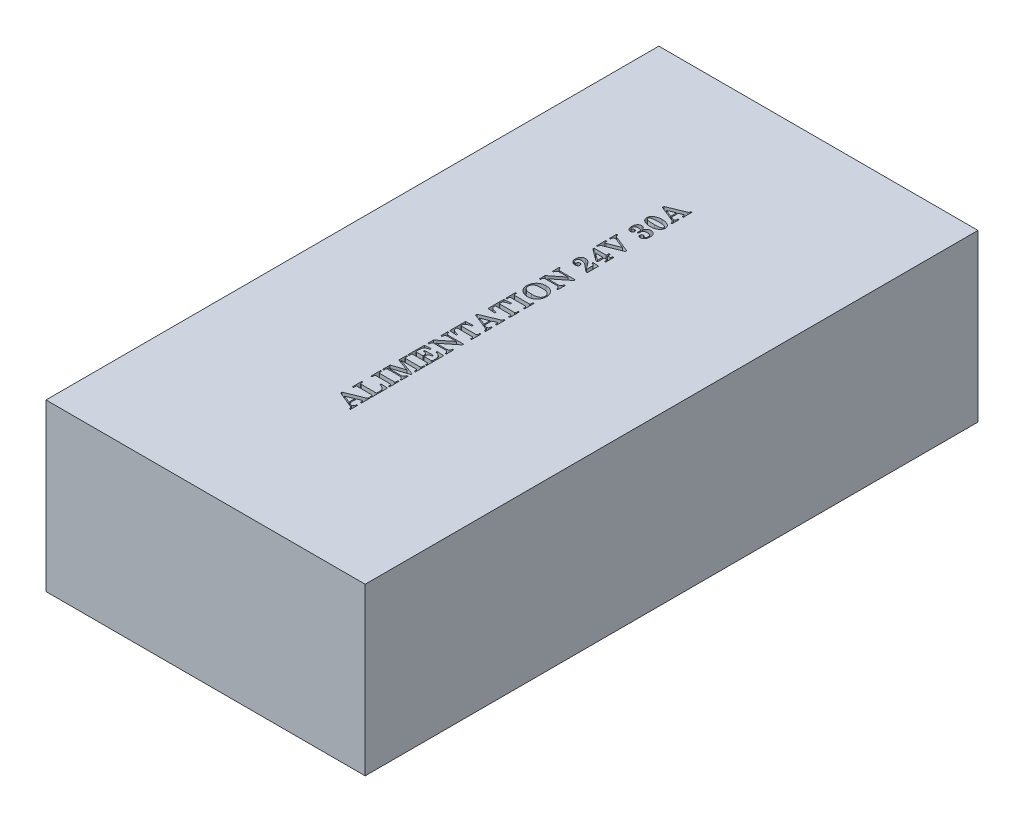
from build123d import *

# Parameters (mm, degrees)
ESQUISSE1_W             = 125
ESQUISSE1_H             = 65
BOSS_EXTRU_1_DEPTH      = 240
ENL_V_MAT_EXTRU_1_DEPTH = 10


with BuildPart() as part:
    # Esquisse1 → Boss.-Extru.1 (new body)
    with BuildSketch(Plane.XY):
        Rectangle(ESQUISSE1_W, ESQUISSE1_H)
    extrude(amount=-BOSS_EXTRU_1_DEPTH)

    # Esquisse2 → Enlèv. mat.-Extru.1 (cut)
    # profile 1 of 18: a face of its own
    with BuildSketch(Plane(origin=(0, 32.5, 0), x_dir=(1, 0, 0), z_dir=(0, 1, 0))):
        with BuildLine():
            Line((-7.149586369, 60.613021655), (-0.584721727, 63.315425775))
            add(Edge.make_bspline(
                [(-0.584721727, 63.315425775), (-0.542867959, 63.333228574), (-0.464993553, 63.366353009), (-0.361061613, 63.42366237), (-0.278080251, 63.482409943), (-0.215423115, 63.546783717), (-0.171712462, 63.618750423), (-0.1413556, 63.698701189), (-0.121321809, 63.788535648), (-0.11976194, 63.85188266), (-0.118941504, 63.885200953)],
                knots=[0, 0, 0, 0, 1.370942679, 2.550818034, 3.572752669, 4.42676234, 5.239938644, 6.093059316, 6.997016507, 8, 8, 8, 8], degree=3))
            Line((-0.118941504, 63.885200953), (-0.118941504, 64.129808805))
            Line((-0.118941504, 64.129808805), (0.349768153, 64.129808805))
            Line((0.349768153, 64.129808805), (0.349768153, 60.75509927))
            Line((0.349768153, 60.75509927), (-0.118941504, 60.75509927))
            Line((-0.118941504, 60.75509927), (-0.118941504, 61.071478289))
            add(Edge.make_bspline(
                [(-0.118941504, 61.071478289), (-0.120152954, 61.129119004), (-0.12236496, 61.234366126), (-0.135568711, 61.37830295), (-0.160249604, 61.493647982), (-0.196904545, 61.582205058), (-0.24288195, 61.646990366), (-0.294102352, 61.694137991), (-0.354582426, 61.72298885), (-0.397428896, 61.726093601), (-0.419208629, 61.72767181)],
                knots=[0, 0, 0, 0, 1.73463371, 3.167295964, 4.343378082, 5.271293548, 6.029597825, 6.716510411, 7.347576117, 8, 8, 8, 8], degree=3))
            add(Edge.make_bspline(
                [(-0.419208629, 61.72767181), (-0.458164527, 61.724480635), (-0.543530855, 61.717487628), (-0.623350829, 61.686130683), (-0.666745917, 61.669083102)],
                knots=[0, 0, 0, 0, 0.912675961, 2, 2, 2, 2], degree=3))
            Line((-0.666745917, 61.669083102), (-1.993780135, 61.124208125))
            Line((-1.993780135, 61.124208125), (-1.993780135, 58.439380617))
            Line((-1.993780135, 58.439380617), (-1.388851733, 58.193308047))
            add(Edge.make_bspline(
                [(-1.388851733, 58.193308047), (-1.330061147, 58.168606106), (-1.221853288, 58.123140592), (-1.068895964, 58.071443065), (-0.940162887, 58.037302844), (-0.861210294, 58.031720791), (-0.826400144, 58.029259667)],
                knots=[0, 0, 0, 0, 1.298659012, 2.390265557, 3.29026905, 4, 4, 4, 4], degree=3))
            add(Edge.make_bspline(
                [(-0.826400144, 58.029259667), (-0.776223575, 58.031785187), (-0.678053188, 58.036726363), (-0.539006108, 58.084146812), (-0.415033656, 58.161067521), (-0.309453797, 58.268537451), (-0.222930372, 58.400778541), (-0.160982258, 58.557071399), (-0.124580433, 58.734553937), (-0.120877202, 58.860062767), (-0.118941504, 58.925666887)],
                knots=[0, 0, 0, 0, 0.936507569, 1.832275744, 2.714661229, 3.645086353, 4.628433735, 5.653316655, 6.773376366, 8, 8, 8, 8], degree=3))
            Line((-0.118941504, 58.925666887), (-0.118941504, 59.161486434))
            Line((-0.118941504, 59.161486434), (0.349768153, 59.161486434))
            Line((0.349768153, 59.161486434), (0.349768153, 56.349228488))
            Line((0.349768153, 56.349228488), (-0.118941504, 56.349228488))
            Line((-0.118941504, 56.349228488), (-0.118941504, 56.517671021))
            add(Edge.make_bspline(
                [(-0.118941504, 56.517671021), (-0.120791479, 56.563761787), (-0.124417059, 56.654090458), (-0.156574327, 56.784661474), (-0.20739498, 56.907252054), (-0.257673099, 56.979364103), (-0.282989884, 57.015675032)],
                knots=[0, 0, 0, 0, 1.034931053, 2.028257604, 3.007159006, 4, 4, 4, 4], degree=3))
            add(Edge.make_bspline(
                [(-0.282989884, 57.015675032), (-0.323328429, 57.064602789), (-0.40395275, 57.1623943), (-0.54644719, 57.290265379), (-0.704908761, 57.40112452), (-0.82072483, 57.459393996), (-0.87912998, 57.488778843)],
                knots=[0, 0, 0, 0, 0.989267864, 1.977241644, 2.979938569, 4, 4, 4, 4], degree=3))
            Line((-0.87912998, 57.488778843), (-7.149586369, 60.031528736))
            Line((-7.149586369, 60.031528736), (-7.149586369, 60.613021655))
        make_face()
        Polygon((-5.279141892, 59.770808989), (-2.462489793, 58.628329198), (-2.462489793, 60.930865392), align=None, mode=Mode.SUBTRACT)
    # profile 2 of 18: a face of its own
    with BuildSketch(Plane(origin=(0, 32.5, 0), x_dir=(1, 0, 0), z_dir=(0, 1, 0))):
        with BuildLine():
            Line((-6.493392849, 64.4110346), (-6.962102506, 64.4110346))
            Line((-6.962102506, 64.4110346), (-6.962102506, 68.160711861))
            Line((-6.962102506, 68.160711861), (-6.493392849, 68.160711861))
            Line((-6.493392849, 68.160711861), (-6.493392849, 67.526489106))
            add(Edge.make_bspline(
                [(-6.493392849, 67.526489106), (-6.492880334, 67.484346583), (-6.491931172, 67.406299967), (-6.469966449, 67.2998042), (-6.442185048, 67.210710568), (-6.394379812, 67.141970425), (-6.33036631, 67.093221476), (-6.251910694, 67.059772175), (-6.157992789, 67.039563813), (-6.090218084, 67.037117029), (-6.053977545, 67.035808683)],
                knots=[0, 0, 0, 0, 1.315738024, 2.436705103, 3.393801134, 4.216377008, 5.011227331, 5.88019691, 6.866497342, 8, 8, 8, 8], degree=3))
            Line((-6.053977545, 67.035808683), (-0.631592692, 67.035808683))
            add(Edge.make_bspline(
                [(-0.631592692, 67.035808683), (-0.581675698, 67.036320165), (-0.491079952, 67.037248467), (-0.369874973, 67.057809126), (-0.275766681, 67.086899548), (-0.20521253, 67.137282803), (-0.162500952, 67.21807568), (-0.138684557, 67.326994644), (-0.121005121, 67.469309074), (-0.11967874, 67.57572792), (-0.118941504, 67.634878214)],
                knots=[0, 0, 0, 0, 1.253903632, 2.275744688, 3.0838611, 3.715249658, 4.397853843, 5.324441336, 6.512856611, 8, 8, 8, 8], degree=3))
            Line((-0.118941504, 67.634878214), (-0.118941504, 68.699727968))
            add(Edge.make_bspline(
                [(-0.118941504, 68.699727968), (-0.120709922, 68.749148144), (-0.124234015, 68.847632386), (-0.150280795, 68.993499261), (-0.191037073, 69.136749161), (-0.250735499, 69.277021392), (-0.327309268, 69.414600308), (-0.420168102, 69.549795745), (-0.529761727, 69.68228119), (-0.655235805, 69.812507812), (-0.799621461, 69.937939523), (-0.964744313, 70.055036136), (-1.149851442, 70.164314997), (-1.354694863, 70.26754337), (-1.579917858, 70.361191028), (-1.824316807, 70.450280557), (-2.089518895, 70.528073741), (-2.273862918, 70.574239695), (-2.368747861, 70.598002081)],
                knots=[0, 0, 0, 0, 0.746912636, 1.488443168, 2.23374891, 2.994684548, 3.787708599, 4.610844269, 5.470984714, 6.384614629, 7.342277412, 8.358337279, 9.440799591, 10.589692343, 11.823661849, 13.126691512, 14.521060192, 16, 16, 16, 16], degree=3))
            Line((-2.368747861, 70.598002081), (-2.368747861, 71.066711739))
            Line((-2.368747861, 71.066711739), (0.349768153, 70.879227876))
            Line((0.349768153, 70.879227876), (0.349768153, 64.4110346))
            Line((0.349768153, 64.4110346), (-0.118941504, 64.4110346))
            Line((-0.118941504, 64.4110346), (-0.118941504, 65.084804733))
            add(Edge.make_bspline(
                [(-0.118941504, 65.084804733), (-0.12059664, 65.119497294), (-0.123747654, 65.185544292), (-0.140389825, 65.279079923), (-0.177862563, 65.357099961), (-0.224138592, 65.423881278), (-0.286429579, 65.473767784), (-0.358024201, 65.51209441), (-0.442618639, 65.531785266), (-0.502124413, 65.534505477), (-0.533456608, 65.535937778)],
                knots=[0, 0, 0, 0, 1.195021192, 2.275057257, 3.236625111, 4.150083713, 5.044361992, 5.95302469, 6.922184756, 8, 8, 8, 8], degree=3))
            Line((-0.533456608, 65.535937778), (-6.108172099, 65.535937778))
            add(Edge.make_bspline(
                [(-6.108172099, 65.535937778), (-6.139570536, 65.534732998), (-6.198852546, 65.532458305), (-6.281427389, 65.510266938), (-6.351075194, 65.473602151), (-6.406822716, 65.419492296), (-6.447000199, 65.346689667), (-6.473490535, 65.254786674), (-6.490828834, 65.143061217), (-6.492494475, 65.061446896), (-6.493392849, 65.017427719)],
                knots=[0, 0, 0, 0, 1.009172831, 1.90537486, 2.728410725, 3.517726287, 4.369825449, 5.374211662, 6.5837652, 8, 8, 8, 8], degree=3))
            Line((-6.493392849, 65.017427719), (-6.493392849, 64.4110346))
        make_face()
    # profile 3 of 18: a face of its own
    with BuildSketch(Plane(origin=(0, 32.5, 0), x_dir=(1, 0, 0), z_dir=(0, 1, 0))):
        with BuildLine():
            Line((-6.962102506, 71.72290526), (-6.962102506, 75.472582521))
            Line((-6.962102506, 75.472582521), (-6.493392849, 75.472582521))
            Line((-6.493392849, 75.472582521), (-6.493392849, 74.775376905))
            add(Edge.make_bspline(
                [(-6.493392849, 74.775376905), (-6.492337629, 74.74063063), (-6.490362648, 74.675598458), (-6.474317222, 74.585342098), (-6.449304838, 74.508853573), (-6.41026907, 74.447911002), (-6.359687675, 74.402386425), (-6.300084241, 74.369794216), (-6.229985461, 74.350022077), (-6.180082849, 74.348492002), (-6.153578347, 74.347679343)],
                knots=[0, 0, 0, 0, 1.332052342, 2.493109215, 3.506175236, 4.399811825, 5.235207467, 6.090320786, 6.985722488, 8, 8, 8, 8], degree=3))
            Line((-6.153578347, 74.347679343), (-0.508556407, 74.347679343))
            add(Edge.make_bspline(
                [(-0.508556407, 74.347679343), (-0.477687763, 74.34914882), (-0.420164292, 74.35188718), (-0.340436217, 74.370074299), (-0.274100362, 74.403661992), (-0.242610573, 74.437960758), (-0.227330613, 74.454603733)],
                knots=[0, 0, 0, 0, 1.189604169, 2.216817848, 3.134736875, 4, 4, 4, 4], degree=3))
            add(Edge.make_bspline(
                [(-0.227330613, 74.454603733), (-0.21072689, 74.479453706), (-0.175790129, 74.531741834), (-0.141220393, 74.625487902), (-0.123441749, 74.734165934), (-0.120497746, 74.810952013), (-0.118941504, 74.851542225)],
                knots=[0, 0, 0, 0, 0.854627482, 1.798266405, 2.836132369, 4, 4, 4, 4], degree=3))
            Line((-0.118941504, 74.851542225), (-0.118941504, 75.472582521))
            Line((-0.118941504, 75.472582521), (0.349768153, 75.472582521))
            Line((0.349768153, 75.472582521), (0.349768153, 71.72290526))
            Line((0.349768153, 71.72290526), (-0.118941504, 71.72290526))
            Line((-0.118941504, 71.72290526), (-0.118941504, 72.302933461))
            add(Edge.make_bspline(
                [(-0.118941504, 72.302933461), (-0.119707319, 72.349412192), (-0.121125912, 72.435509208), (-0.139980987, 72.553165348), (-0.168946474, 72.650208959), (-0.214633919, 72.724569261), (-0.270560625, 72.78228936), (-0.340274949, 72.81990391), (-0.420450231, 72.844885674), (-0.4780704, 72.84679712), (-0.508556407, 72.847808438)],
                knots=[0, 0, 0, 0, 1.452570087, 2.690735, 3.719729969, 4.597441136, 5.396806973, 6.204017038, 7.049771118, 8, 8, 8, 8], degree=3))
            Line((-0.508556407, 72.847808438), (-6.089130769, 72.847808438))
            add(Edge.make_bspline(
                [(-6.089130769, 72.847808438), (-6.121450391, 72.846416284), (-6.182429887, 72.843789617), (-6.267722106, 72.824115273), (-6.339350976, 72.787660073), (-6.398485331, 72.737183666), (-6.441392479, 72.669427399), (-6.47228784, 72.587839065), (-6.490915959, 72.490752876), (-6.492533976, 72.420685817), (-6.493392849, 72.383492933)],
                knots=[0, 0, 0, 0, 1.095378829, 2.066721191, 2.940075195, 3.796327793, 4.668426527, 5.62728252, 6.74051792, 8, 8, 8, 8], degree=3))
            Line((-6.493392849, 72.383492933), (-6.493392849, 71.72290526))
            Line((-6.493392849, 71.72290526), (-6.962102506, 71.72290526))
        make_face()
    # profile 4 of 18: a face of its own
    with BuildSketch(Plane(origin=(0, 32.5, 0), x_dir=(1, 0, 0), z_dir=(0, 1, 0))):
        with BuildLine():
            Line((-6.962102506, 76.222517973), (-6.962102506, 79.239836394))
            Line((-6.962102506, 79.239836394), (-2.008427312, 80.862743584))
            Line((-2.008427312, 80.862743584), (-6.962102506, 82.6204048))
            Line((-6.962102506, 82.6204048), (-6.962102506, 85.596711127))
            Line((-6.962102506, 85.596711127), (-6.493392849, 85.596711127))
            Line((-6.493392849, 85.596711127), (-6.493392849, 84.915617405))
            add(Edge.make_bspline(
                [(-6.493392849, 84.915617405), (-6.492327049, 84.876507439), (-6.490370948, 84.804727498), (-6.475267148, 84.706167264), (-6.448321841, 84.627195803), (-6.409084307, 84.564514671), (-6.351480611, 84.522244611), (-6.281711799, 84.491380697), (-6.195349186, 84.474487281), (-6.133141378, 84.472750453), (-6.099383793, 84.471807948)],
                knots=[0, 0, 0, 0, 1.350086966, 2.477863657, 3.426848329, 4.21688017, 4.985587876, 5.853253724, 6.835050263, 8, 8, 8, 8], degree=3))
            Line((-6.099383793, 84.471807948), (-0.527597737, 84.471807948))
            add(Edge.make_bspline(
                [(-0.527597737, 84.471807948), (-0.495189944, 84.472435475), (-0.434490267, 84.47361083), (-0.353020837, 84.494579682), (-0.28413935, 84.524416775), (-0.252813267, 84.558007545), (-0.237583636, 84.574338186)],
                knots=[0, 0, 0, 0, 1.218960044, 2.283107694, 3.165307859, 4, 4, 4, 4], degree=3))
            add(Edge.make_bspline(
                [(-0.237583636, 84.574338186), (-0.219464227, 84.602100967), (-0.182121863, 84.659317395), (-0.144486233, 84.759279411), (-0.122673473, 84.872180875), (-0.120224059, 84.951640858), (-0.118941504, 84.993247442)],
                knots=[0, 0, 0, 0, 0.896584647, 1.847774989, 2.873058759, 4, 4, 4, 4], degree=3))
            Line((-0.118941504, 84.993247442), (-0.118941504, 85.596711127))
            Line((-0.118941504, 85.596711127), (0.349768153, 85.596711127))
            Line((0.349768153, 85.596711127), (0.349768153, 81.847033865))
            Line((0.349768153, 81.847033865), (-0.118941504, 81.847033865))
            Line((-0.118941504, 81.847033865), (-0.118941504, 82.566210246))
            add(Edge.make_bspline(
                [(-0.118941504, 82.566210246), (-0.120457988, 82.597534775), (-0.123309541, 82.656436536), (-0.141598438, 82.74034169), (-0.177335632, 82.810975536), (-0.225473207, 82.870520553), (-0.28630416, 82.915766598), (-0.358041799, 82.948844777), (-0.440019817, 82.96962003), (-0.498663058, 82.971146009), (-0.529062455, 82.971937044)],
                knots=[0, 0, 0, 0, 1.146413735, 2.155684119, 3.114060976, 4.014976285, 4.932899767, 5.859640496, 6.8904836, 8, 8, 8, 8], degree=3))
            Line((-0.529062455, 82.971937044), (-6.502181155, 82.971937044))
            Line((-6.502181155, 82.971937044), (0.349768153, 80.540505695))
            Line((0.349768153, 80.540505695), (0.349768153, 80.080584343))
            Line((0.349768153, 80.080584343), (-6.56223458, 77.816130809))
            Line((-6.56223458, 77.816130809), (-1.224803353, 77.816130809))
            add(Edge.make_bspline(
                [(-1.224803353, 77.816130809), (-1.151189497, 77.819064585), (-1.00909867, 77.824727414), (-0.806276366, 77.881156881), (-0.624740655, 77.972888718), (-0.465023019, 78.101167822), (-0.332747984, 78.264994736), (-0.227097769, 78.460665585), (-0.154154121, 78.689798543), (-0.131055035, 78.85460621), (-0.118941504, 78.941033988)],
                knots=[0, 0, 0, 0, 1.006409277, 1.942589819, 2.857848294, 3.775961278, 4.726508601, 5.723047161, 6.805929504, 8, 8, 8, 8], degree=3))
            Line((-0.118941504, 78.941033988), (0.349768153, 78.941033988))
            Line((0.349768153, 78.941033988), (0.349768153, 76.222517973))
            Line((0.349768153, 76.222517973), (-0.118941504, 76.222517973))
            add(Edge.make_bspline(
                [(-0.118941504, 76.222517973), (-0.122923673, 76.266102123), (-0.130672942, 76.350916531), (-0.157107841, 76.473452827), (-0.18858642, 76.588664197), (-0.227854349, 76.69715538), (-0.27810824, 76.797029265), (-0.33699119, 76.889397252), (-0.403107766, 76.975244049), (-0.477752184, 77.052878189), (-0.559920046, 77.121156374), (-0.646777098, 77.182138048), (-0.739347707, 77.233003574), (-0.83688189, 77.276629728), (-0.940772112, 77.308454458), (-1.05036659, 77.32958841), (-1.164291596, 77.345501888), (-1.242321739, 77.346774974), (-1.281927342, 77.347421152)],
                knots=[0, 0, 0, 0, 1.164646532, 2.266392847, 3.332807303, 4.344956452, 5.333609247, 6.304048799, 7.258676366, 8.215162133, 9.165884551, 10.100189995, 11.037386914, 11.974854452, 12.941452738, 13.923325924, 14.945946719, 16, 16, 16, 16], degree=3))
            Line((-1.281927342, 77.347421152), (-5.995388837, 77.347421152))
            add(Edge.make_bspline(
                [(-5.995388837, 77.347421152), (-6.041291889, 77.345857201), (-6.125274674, 77.342995846), (-6.240199738, 77.327008972), (-6.329216708, 77.291157701), (-6.399432105, 77.243007068), (-6.443327114, 77.168893514), (-6.472933995, 77.075564645), (-6.491211845, 76.957500646), (-6.492623495, 76.870479204), (-6.493392849, 76.823052222)],
                knots=[0, 0, 0, 0, 1.283679215, 2.348579275, 3.217174914, 3.948116977, 4.678168034, 5.570837242, 6.676098054, 8, 8, 8, 8], degree=3))
            Line((-6.493392849, 76.823052222), (-6.493392849, 76.222517973))
            Line((-6.493392849, 76.222517973), (-6.962102506, 76.222517973))
        make_face()
    # profile 5 of 18: a face of its own
    with BuildSketch(Plane(origin=(0, 32.5, 0), x_dir=(1, 0, 0), z_dir=(0, 1, 0))):
        with BuildLine():
            Line((-6.962102506, 86.159162716), (-6.962102506, 92.627355992))
            Line((-6.962102506, 92.627355992), (-4.431070355, 92.814839855))
            Line((-4.431070355, 92.814839855), (-4.431070355, 92.346130197))
            add(Edge.make_bspline(
                [(-4.431070355, 92.346130197), (-4.502921202, 92.332873142), (-4.641642128, 92.307278023), (-4.841028145, 92.263560458), (-5.02434594, 92.21593559), (-5.193280586, 92.169340109), (-5.344832696, 92.115318293), (-5.482819251, 92.063871392), (-5.60379951, 92.006646875), (-5.74360461, 91.929461558), (-5.897637423, 91.821437024), (-6.056714903, 91.670405817), (-6.193356623, 91.502196459), (-6.30550113, 91.312655176), (-6.390616864, 91.097593104), (-6.451516474, 90.854969249), (-6.487780994, 90.582725866), (-6.491464342, 90.391337367), (-6.493392849, 90.291131292)],
                knots=[0, 0, 0, 0, 1.072126014, 2.069931256, 2.994381987, 3.851558377, 4.640050982, 5.35453429, 6.01156806, 6.601677569, 7.696918733, 8.761236179, 9.81078961, 10.867507976, 11.979747221, 13.192655014, 14.530146681, 16, 16, 16, 16], degree=3))
            Line((-6.493392849, 90.291131292), (-6.493392849, 89.245322868))
            add(Edge.make_bspline(
                [(-6.493392849, 89.245322868), (-6.492291786, 89.207186298), (-6.490247444, 89.136378137), (-6.475107847, 89.038395488), (-6.447643461, 88.957000833), (-6.407875995, 88.891740576), (-6.356175743, 88.843983221), (-6.297065628, 88.808615714), (-6.228595754, 88.788180178), (-6.180075372, 88.785380955), (-6.155043064, 88.783936799)],
                knots=[0, 0, 0, 0, 1.406216061, 2.610920979, 3.641604559, 4.555777985, 5.396428306, 6.21162811, 7.077355288, 8, 8, 8, 8], degree=3))
            Line((-6.155043064, 88.783936799), (-3.681134903, 88.783936799))
            Line((-3.681134903, 88.783936799), (-3.681134903, 89.135469042))
            add(Edge.make_bspline(
                [(-3.681134903, 89.135469042), (-3.682462014, 89.184808879), (-3.685030256, 89.280291904), (-3.699086132, 89.419642884), (-3.72591064, 89.550372761), (-3.76175277, 89.673285244), (-3.809095566, 89.787119059), (-3.866524219, 89.892597619), (-3.935720444, 89.988717456), (-4.0137567, 90.078073995), (-4.104135442, 90.158067952), (-4.207761683, 90.227872136), (-4.322573461, 90.291475078), (-4.45057035, 90.345797071), (-4.592330154, 90.388862419), (-4.746018266, 90.424945134), (-4.912066379, 90.455389391), (-5.027578084, 90.465874058), (-5.087263876, 90.471291567)],
                knots=[0, 0, 0, 0, 1.08146727, 2.092868002, 3.064377417, 4.002070184, 4.894220017, 5.760922013, 6.627822104, 7.484360468, 8.356001352, 9.264111514, 10.217062164, 11.228576073, 12.304684652, 13.459505582, 14.687306864, 16, 16, 16, 16], degree=3))
            Line((-5.087263876, 90.471291567), (-5.087263876, 90.940001224))
            Line((-5.087263876, 90.940001224), (-1.71255434, 90.940001224))
            Line((-1.71255434, 90.940001224), (-1.71255434, 90.471291567))
            add(Edge.make_bspline(
                [(-1.71255434, 90.471291567), (-1.779032717, 90.466704656), (-1.906974302, 90.457876875), (-2.090804608, 90.432508656), (-2.259625683, 90.400220047), (-2.412428962, 90.355349394), (-2.551412038, 90.305044037), (-2.675361574, 90.243973905), (-2.782654932, 90.171312491), (-2.877120111, 90.091684658), (-2.957226901, 90.000377556), (-3.025809535, 89.899390633), (-3.083782647, 89.787767922), (-3.130051249, 89.66508212), (-3.168289236, 89.532513446), (-3.194637805, 89.388789295), (-3.20848258, 89.234856737), (-3.211084723, 89.128659524), (-3.212425245, 89.0739509)],
                knots=[0, 0, 0, 0, 1.362299272, 2.621825896, 3.792759271, 4.873464759, 5.874935463, 6.812609666, 7.690433608, 8.518889989, 9.332288895, 10.165843518, 11.009856605, 11.898010568, 12.842939099, 13.82795, 14.881045326, 16, 16, 16, 16], degree=3))
            Line((-3.212425245, 89.0739509), (-3.212425245, 88.783936799))
            Line((-3.212425245, 88.783936799), (-0.483656207, 88.783936799))
            add(Edge.make_bspline(
                [(-0.483656207, 88.783936799), (-0.455710162, 88.785410968), (-0.403476043, 88.788166346), (-0.330864955, 88.80651405), (-0.270597757, 88.840596268), (-0.242581387, 88.87428428), (-0.22879533, 88.89086119)],
                knots=[0, 0, 0, 0, 1.167205204, 2.181630186, 3.105232066, 4, 4, 4, 4], degree=3))
            add(Edge.make_bspline(
                [(-0.22879533, 88.89086119), (-0.211418763, 88.920566899), (-0.174870305, 88.98304747), (-0.14331723, 89.094771778), (-0.122813428, 89.22207546), (-0.120277568, 89.313085348), (-0.118941504, 89.361035565)],
                knots=[0, 0, 0, 0, 0.841207128, 1.769326616, 2.82472911, 4, 4, 4, 4], degree=3))
            Line((-0.118941504, 89.361035565), (-0.118941504, 90.270625244))
            add(Edge.make_bspline(
                [(-0.118941504, 90.270625244), (-0.120529846, 90.346872855), (-0.12363506, 90.495937143), (-0.150906285, 90.714493637), (-0.194193452, 90.922478446), (-0.255617602, 91.119898007), (-0.335716605, 91.305312827), (-0.430747861, 91.481446191), (-0.546188322, 91.645675347), (-0.677722993, 91.800156147), (-0.828168075, 91.940785888), (-0.994995243, 92.069428519), (-1.179732398, 92.18389446), (-1.383689336, 92.281473002), (-1.604541841, 92.366755547), (-1.843085748, 92.437768741), (-2.09945097, 92.495763446), (-2.277221997, 92.520749782), (-2.368747861, 92.53361406)],
                knots=[0, 0, 0, 0, 1.031706111, 2.016988254, 2.976125688, 3.904159658, 4.81009441, 5.706189394, 6.608162384, 7.52208861, 8.447766562, 9.390230061, 10.369554486, 11.383346966, 12.446163406, 13.570987643, 14.749416833, 16, 16, 16, 16], degree=3))
            Line((-2.368747861, 92.53361406), (-2.368747861, 93.002323718))
            Line((-2.368747861, 93.002323718), (0.349768153, 92.908581786))
            Line((0.349768153, 92.908581786), (0.349768153, 86.159162716))
            Line((0.349768153, 86.159162716), (-0.118941504, 86.159162716))
            Line((-0.118941504, 86.159162716), (-0.118941504, 86.824144543))
            add(Edge.make_bspline(
                [(-0.118941504, 86.824144543), (-0.120441958, 86.859356465), (-0.123304405, 86.92653101), (-0.142027846, 87.021381824), (-0.180564582, 87.10142684), (-0.230167332, 87.168560566), (-0.292977469, 87.220331849), (-0.365614969, 87.25832554), (-0.448720933, 87.280184832), (-0.507452197, 87.282742222), (-0.537850761, 87.284065894)],
                knots=[0, 0, 0, 0, 1.198757178, 2.286894981, 3.260211708, 4.196987969, 5.1050531, 6.003957958, 6.966873725, 8, 8, 8, 8], degree=3))
            Line((-0.537850761, 87.284065894), (-6.147719476, 87.284065894))
            add(Edge.make_bspline(
                [(-6.147719476, 87.284065894), (-6.17569402, 87.282817612), (-6.228722215, 87.280451383), (-6.302570568, 87.258604361), (-6.36372319, 87.220131315), (-6.41478502, 87.166682533), (-6.45139508, 87.091817291), (-6.477038684, 86.996074859), (-6.489734222, 86.877199218), (-6.492108858, 86.790476792), (-6.493392849, 86.74358507)],
                knots=[0, 0, 0, 0, 0.911783951, 1.72836626, 2.480019639, 3.246558688, 4.108965725, 5.168374927, 6.468910761, 8, 8, 8, 8], degree=3))
            Line((-6.493392849, 86.74358507), (-6.493392849, 86.159162716))
            Line((-6.493392849, 86.159162716), (-6.962102506, 86.159162716))
        make_face()
    # profile 6 of 18: a face of its own
    with BuildSketch(Plane(origin=(0, 32.5, 0), x_dir=(1, 0, 0), z_dir=(0, 1, 0))):
        with BuildLine():
            Line((-6.962102506, 93.939743033), (-6.962102506, 96.221773179))
            Line((-6.962102506, 96.221773179), (-1.95276804, 100.220452446))
            Line((-1.95276804, 100.220452446), (-5.34944834, 100.220452446))
            add(Edge.make_bspline(
                [(-5.34944834, 100.220452446), (-5.390491596, 100.219626363), (-5.470359985, 100.21801884), (-5.587154924, 100.205001044), (-5.697342808, 100.181276814), (-5.801831935, 100.149109173), (-5.900129742, 100.108273106), (-5.992229813, 100.058086022), (-6.077244561, 99.997518299), (-6.156062219, 99.92871108), (-6.228880092, 99.852575011), (-6.291296337, 99.766584553), (-6.347842303, 99.674745447), (-6.393012255, 99.573378925), (-6.430712007, 99.464997379), (-6.462191442, 99.349243282), (-6.482041962, 99.22496356), (-6.489533987, 99.139545113), (-6.493392849, 99.095549268)],
                knots=[0, 0, 0, 0, 1.094921326, 2.130669264, 3.129639207, 4.097901396, 5.043824247, 5.964934961, 6.890181388, 7.82273491, 8.753467036, 9.693992794, 10.652390676, 11.6258962, 12.647623494, 13.712452977, 14.821770132, 16, 16, 16, 16], degree=3))
            Line((-6.493392849, 99.095549268), (-6.962102506, 99.095549268))
            Line((-6.962102506, 99.095549268), (-6.962102506, 101.814065282))
            Line((-6.962102506, 101.814065282), (-6.493392849, 101.814065282))
            add(Edge.make_bspline(
                [(-6.493392849, 101.814065282), (-6.488161095, 101.765643659), (-6.47802113, 101.671794895), (-6.452997358, 101.536722534), (-6.421079492, 101.412411208), (-6.382704969, 101.298932136), (-6.339615319, 101.194994403), (-6.286178727, 101.102937396), (-6.228127744, 101.020313688), (-6.162330501, 100.948237708), (-6.088566386, 100.886795268), (-6.007219138, 100.833214845), (-5.916793369, 100.789487882), (-5.818578516, 100.753230381), (-5.712428901, 100.723448135), (-5.598112615, 100.703452242), (-5.475655154, 100.691851109), (-5.391462932, 100.690077861), (-5.347983623, 100.689162104)],
                knots=[0, 0, 0, 0, 1.284761651, 2.490071306, 3.621218687, 4.668242555, 5.649389753, 6.584191163, 7.470787675, 8.30967397, 9.150931122, 9.997792456, 10.873558607, 11.794857465, 12.757561686, 13.778501154, 14.852753438, 16, 16, 16, 16], degree=3))
            Line((-5.347983623, 100.689162104), (0.349768153, 100.689162104))
            Line((0.349768153, 100.689162104), (0.349768153, 100.166257892))
            Line((0.349768153, 100.166257892), (-5.336265881, 95.627097801))
            Line((-5.336265881, 95.627097801), (-1.409357781, 95.627097801))
            add(Edge.make_bspline(
                [(-1.409357781, 95.627097801), (-1.35512624, 95.627758936), (-1.250353578, 95.629036218), (-1.098567991, 95.643981161), (-0.957822675, 95.668236479), (-0.828917793, 95.70329202), (-0.711330937, 95.747281511), (-0.605137596, 95.8017713), (-0.509671202, 95.86561327), (-0.427036123, 95.94011384), (-0.355022992, 96.021215292), (-0.292316073, 96.107873946), (-0.237145881, 96.198246531), (-0.195092651, 96.294781873), (-0.161170129, 96.39472737), (-0.136077081, 96.499055113), (-0.120995139, 96.608501405), (-0.11963609, 96.683110538), (-0.118941504, 96.721241908)],
                knots=[0, 0, 0, 0, 1.356407093, 2.620511581, 3.811437026, 4.925655043, 5.957912504, 6.94675836, 7.905571811, 8.822623903, 9.722428917, 10.614238466, 11.496205548, 12.365648531, 13.242525342, 14.134334891, 15.046492523, 16, 16, 16, 16], degree=3))
            Line((-0.118941504, 96.721241908), (-0.118941504, 96.845742911))
            Line((-0.118941504, 96.845742911), (0.349768153, 96.845742911))
            Line((0.349768153, 96.845742911), (0.349768153, 93.939743033))
            Line((0.349768153, 93.939743033), (-0.118941504, 93.939743033))
            Line((-0.118941504, 93.939743033), (-0.118941504, 94.140409355))
            add(Edge.make_bspline(
                [(-0.118941504, 94.140409355), (-0.120310246, 94.175597122), (-0.123002362, 94.244806341), (-0.137043417, 94.346803361), (-0.164473589, 94.444184826), (-0.20004272, 94.538341083), (-0.249793575, 94.626204076), (-0.307283686, 94.711169517), (-0.3759869, 94.791312241), (-0.455456203, 94.865898462), (-0.542470361, 94.933616287), (-0.635103395, 94.995281856), (-0.735862276, 95.044018864), (-0.841007615, 95.087387074), (-0.953019346, 95.119641009), (-1.071403545, 95.140624685), (-1.195088629, 95.156453351), (-1.279921082, 95.157737138), (-1.322939437, 95.158388143)],
                knots=[0, 0, 0, 0, 0.959642322, 1.887476854, 2.797873497, 3.712249293, 4.623520897, 5.542629668, 6.505404171, 7.49386443, 8.508145709, 9.50844957, 10.520195906, 11.553162429, 12.606081248, 13.689261322, 14.828229357, 16, 16, 16, 16], degree=3))
            Line((-1.322939437, 95.158388143), (-5.923617671, 95.158388143))
            add(Edge.make_bspline(
                [(-5.923617671, 95.158388143), (-5.968671491, 95.12949826), (-6.055797506, 95.073630402), (-6.172296619, 94.977838223), (-6.270697016, 94.876430314), (-6.354207145, 94.770341597), (-6.414518898, 94.65479167), (-6.461644185, 94.535450342), (-6.488397016, 94.409140868), (-6.491713027, 94.32312924), (-6.493392849, 94.279557535)],
                knots=[0, 0, 0, 0, 1.168505219, 2.259679725, 3.28550811, 4.251890424, 5.196784971, 6.121846265, 7.048566313, 8, 8, 8, 8], degree=3))
            Line((-6.493392849, 94.279557535), (-6.493392849, 93.939743033))
            Line((-6.493392849, 93.939743033), (-6.962102506, 93.939743033))
        make_face()
    # profile 7 of 18: a face of its own
    with BuildSketch(Plane(origin=(0, 32.5, 0), x_dir=(1, 0, 0), z_dir=(0, 1, 0))):
        with BuildLine():
            Line((-6.962102506, 102.564000735), (-6.962102506, 108.750968216))
            Line((-6.962102506, 108.750968216), (-4.14984456, 108.938452079))
            Line((-4.14984456, 108.938452079), (-4.14984456, 108.469742421))
            add(Edge.make_bspline(
                [(-4.14984456, 108.469742421), (-4.223146206, 108.456913791), (-4.366152189, 108.431886102), (-4.573743134, 108.389467815), (-4.768688996, 108.344287884), (-4.950885183, 108.295880572), (-5.120935224, 108.244730474), (-5.278941114, 108.190997032), (-5.424597847, 108.133786193), (-5.597278082, 108.055934925), (-5.78994607, 107.953484849), (-5.990084736, 107.818183144), (-6.154989062, 107.673583118), (-6.283363254, 107.51866957), (-6.37575067, 107.353944847), (-6.445493966, 107.185342001), (-6.48585853, 107.007403727), (-6.490865791, 106.886089269), (-6.493392849, 106.824864466)],
                knots=[0, 0, 0, 0, 1.144205209, 2.232258099, 3.257504094, 4.220821774, 5.130455352, 5.987514631, 6.786337039, 7.535647735, 8.899349213, 10.136246357, 11.242255084, 12.261187233, 13.212850024, 14.135739377, 15.05914768, 16, 16, 16, 16], degree=3))
            add(Edge.make_bspline(
                [(-6.493392849, 106.824864466), (-6.492560487, 106.791053146), (-6.491014839, 106.728267437), (-6.472401643, 106.641115305), (-6.446453568, 106.566831459), (-6.405285579, 106.506863961), (-6.352161316, 106.462068687), (-6.289713864, 106.429510997), (-6.216749851, 106.409790284), (-6.164940406, 106.408241323), (-6.137466452, 106.407419927)],
                knots=[0, 0, 0, 0, 1.289927632, 2.395322688, 3.393589549, 4.278866149, 5.139200359, 6.024083415, 6.952194123, 8, 8, 8, 8], degree=3))
            Line((-6.137466452, 106.407419927), (-0.489515077, 106.407419927))
            add(Edge.make_bspline(
                [(-0.489515077, 106.407419927), (-0.463479197, 106.408270912), (-0.413083441, 106.409918101), (-0.342071485, 106.430420216), (-0.276983123, 106.459220984), (-0.221904286, 106.50227104), (-0.176430399, 106.552866244), (-0.143500928, 106.610288462), (-0.121428653, 106.672417028), (-0.11977613, 106.716288381), (-0.118941504, 106.738446123)],
                knots=[0, 0, 0, 0, 1.124233944, 2.176097785, 3.179193085, 4.190284842, 5.17923077, 6.10798538, 7.044415779, 8, 8, 8, 8], degree=3))
            Line((-0.118941504, 106.738446123), (-0.118941504, 107.532323106))
            Line((-0.118941504, 107.532323106), (0.349768153, 107.532323106))
            Line((0.349768153, 107.532323106), (0.349768153, 103.782645844))
            Line((0.349768153, 103.782645844), (-0.118941504, 103.782645844))
            Line((-0.118941504, 103.782645844), (-0.118941504, 104.538440167))
            add(Edge.make_bspline(
                [(-0.118941504, 104.538440167), (-0.1198444, 104.565414836), (-0.12157733, 104.617187379), (-0.141001255, 104.690631093), (-0.173818127, 104.754842269), (-0.21833622, 104.809561449), (-0.272755901, 104.854415923), (-0.337747673, 104.885112944), (-0.410708458, 104.90503534), (-0.462520059, 104.906687967), (-0.489515077, 104.907549023)],
                knots=[0, 0, 0, 0, 1.09441265, 2.100508727, 3.05909292, 4.004437508, 4.949782095, 5.899491273, 6.90558735, 8, 8, 8, 8], degree=3))
            Line((-0.489515077, 104.907549023), (-6.108172099, 104.907549023))
            add(Edge.make_bspline(
                [(-6.108172099, 104.907549023), (-6.139057968, 104.90673411), (-6.197119069, 104.905202188), (-6.278206105, 104.885762763), (-6.34737112, 104.854323332), (-6.402281994, 104.806464229), (-6.444543253, 104.745664553), (-6.473077348, 104.670821515), (-6.490806172, 104.582227959), (-6.492488009, 104.518520598), (-6.493392849, 104.484245613)],
                knots=[0, 0, 0, 0, 1.121837009, 2.108896173, 3.01505072, 3.859320764, 4.727019023, 5.684024888, 6.753989972, 8, 8, 8, 8], degree=3))
            add(Edge.make_bspline(
                [(-6.493392849, 104.484245613), (-6.491896379, 104.434786287), (-6.488937971, 104.337008942), (-6.459494352, 104.193881953), (-6.414487997, 104.056080401), (-6.348709299, 103.925198176), (-6.266618628, 103.799479571), (-6.163811417, 103.6822658), (-6.044372779, 103.570075206), (-5.905819831, 103.46514336), (-5.749628313, 103.365212054), (-5.575295182, 103.27171925), (-5.381802778, 103.18590634), (-5.171525401, 103.103588109), (-4.941840423, 103.029532407), (-4.694703741, 102.960623501), (-4.428535197, 102.899637092), (-4.244669788, 102.863739867), (-4.14984456, 102.845226529)],
                knots=[0, 0, 0, 0, 0.764794847, 1.511941548, 2.25294511, 3.003411038, 3.772823894, 4.57138868, 5.410971192, 6.30599092, 7.257932273, 8.279279253, 9.365290914, 10.533183777, 11.773787884, 13.099723235, 14.504235206, 16, 16, 16, 16], degree=3))
            Line((-4.14984456, 102.845226529), (-4.14984456, 102.376516871))
            Line((-4.14984456, 102.376516871), (-6.962102506, 102.564000735))
        make_face()
    # profile 8 of 18: a face of its own
    with BuildSketch(Plane(origin=(0, 32.5, 0), x_dir=(1, 0, 0), z_dir=(0, 1, 0))):
        with BuildLine():
            Line((-7.149586369, 113.483471041), (-0.584721727, 116.185875161))
            add(Edge.make_bspline(
                [(-0.584721727, 116.185875161), (-0.542867959, 116.20367796), (-0.464993553, 116.236802395), (-0.361061613, 116.294111756), (-0.278080251, 116.352859328), (-0.215423115, 116.417233102), (-0.171712462, 116.489199809), (-0.1413556, 116.569150574), (-0.121321809, 116.658985033), (-0.11976194, 116.722332046), (-0.118941504, 116.755650338)],
                knots=[0, 0, 0, 0, 1.370942679, 2.550818034, 3.572752669, 4.42676234, 5.239938644, 6.093059316, 6.997016507, 8, 8, 8, 8], degree=3))
            Line((-0.118941504, 116.755650338), (-0.118941504, 117.000258191))
            Line((-0.118941504, 117.000258191), (0.349768153, 117.000258191))
            Line((0.349768153, 117.000258191), (0.349768153, 113.625548656))
            Line((0.349768153, 113.625548656), (-0.118941504, 113.625548656))
            Line((-0.118941504, 113.625548656), (-0.118941504, 113.941927675))
            add(Edge.make_bspline(
                [(-0.118941504, 113.941927675), (-0.120152954, 113.99956839), (-0.12236496, 114.104815512), (-0.135568711, 114.248752335), (-0.160249604, 114.364097368), (-0.196904545, 114.452654444), (-0.24288195, 114.517439752), (-0.294102352, 114.564587376), (-0.354582426, 114.593438236), (-0.397428896, 114.596542987), (-0.419208629, 114.598121195)],
                knots=[0, 0, 0, 0, 1.73463371, 3.167295964, 4.343378082, 5.271293548, 6.029597825, 6.716510411, 7.347576117, 8, 8, 8, 8], degree=3))
            add(Edge.make_bspline(
                [(-0.419208629, 114.598121195), (-0.458164527, 114.594930021), (-0.543530855, 114.587937013), (-0.623350829, 114.556580068), (-0.666745917, 114.539532488)],
                knots=[0, 0, 0, 0, 0.912675961, 2, 2, 2, 2], degree=3))
            Line((-0.666745917, 114.539532488), (-1.993780135, 113.994657511))
            Line((-1.993780135, 113.994657511), (-1.993780135, 111.309830003))
            Line((-1.993780135, 111.309830003), (-1.388851733, 111.063757433))
            add(Edge.make_bspline(
                [(-1.388851733, 111.063757433), (-1.330061147, 111.039055492), (-1.221853288, 110.993589978), (-1.068895964, 110.941892451), (-0.940162887, 110.907752229), (-0.861210294, 110.902170177), (-0.826400144, 110.899709053)],
                knots=[0, 0, 0, 0, 1.298659012, 2.390265557, 3.29026905, 4, 4, 4, 4], degree=3))
            add(Edge.make_bspline(
                [(-0.826400144, 110.899709053), (-0.776223575, 110.902234573), (-0.678053188, 110.907175749), (-0.539006108, 110.954596198), (-0.415033656, 111.031516907), (-0.309453797, 111.138986837), (-0.222930372, 111.271227927), (-0.160982258, 111.427520785), (-0.124580433, 111.605003322), (-0.120877202, 111.730512152), (-0.118941504, 111.796116273)],
                knots=[0, 0, 0, 0, 0.936507569, 1.832275744, 2.714661229, 3.645086353, 4.628433735, 5.653316655, 6.773376366, 8, 8, 8, 8], degree=3))
            Line((-0.118941504, 111.796116273), (-0.118941504, 112.03193582))
            Line((-0.118941504, 112.03193582), (0.349768153, 112.03193582))
            Line((0.349768153, 112.03193582), (0.349768153, 109.219677873))
            Line((0.349768153, 109.219677873), (-0.118941504, 109.219677873))
            Line((-0.118941504, 109.219677873), (-0.118941504, 109.388120407))
            add(Edge.make_bspline(
                [(-0.118941504, 109.388120407), (-0.120791479, 109.434211173), (-0.124417059, 109.524539844), (-0.156574327, 109.655110859), (-0.20739498, 109.77770144), (-0.257673099, 109.849813489), (-0.282989884, 109.886124418)],
                knots=[0, 0, 0, 0, 1.034931053, 2.028257604, 3.007159006, 4, 4, 4, 4], degree=3))
            add(Edge.make_bspline(
                [(-0.282989884, 109.886124418), (-0.323328429, 109.935052175), (-0.40395275, 110.032843685), (-0.54644719, 110.160714765), (-0.704908761, 110.271573905), (-0.82072483, 110.329843382), (-0.87912998, 110.359228229)],
                knots=[0, 0, 0, 0, 0.989267864, 1.977241644, 2.979938569, 4, 4, 4, 4], degree=3))
            Line((-0.87912998, 110.359228229), (-7.149586369, 112.901978122))
            Line((-7.149586369, 112.901978122), (-7.149586369, 113.483471041))
        make_face()
        Polygon((-5.279141892, 112.641258375), (-2.462489793, 111.498778584), (-2.462489793, 113.801314777), align=None, mode=Mode.SUBTRACT)
    # profile 9 of 18: a face of its own
    with BuildSketch(Plane(origin=(0, 32.5, 0), x_dir=(1, 0, 0), z_dir=(0, 1, 0))):
        with BuildLine():
            Line((-6.962102506, 117.56270978), (-6.962102506, 123.749677261))
            Line((-6.962102506, 123.749677261), (-4.14984456, 123.937161124))
            Line((-4.14984456, 123.937161124), (-4.14984456, 123.468451467))
            add(Edge.make_bspline(
                [(-4.14984456, 123.468451467), (-4.223146206, 123.455622837), (-4.366152189, 123.430595148), (-4.573743134, 123.388176861), (-4.768688996, 123.34299693), (-4.950885183, 123.294589617), (-5.120935224, 123.24343952), (-5.278941114, 123.189706077), (-5.424597847, 123.132495238), (-5.597278082, 123.054643971), (-5.78994607, 122.952193894), (-5.990084736, 122.81689219), (-6.154989062, 122.672292164), (-6.283363254, 122.517378616), (-6.37575067, 122.352653892), (-6.445493966, 122.184051046), (-6.48585853, 122.006112772), (-6.490865791, 121.884798315), (-6.493392849, 121.823573512)],
                knots=[0, 0, 0, 0, 1.144205209, 2.232258099, 3.257504094, 4.220821774, 5.130455352, 5.987514631, 6.786337039, 7.535647735, 8.899349213, 10.136246357, 11.242255084, 12.261187233, 13.212850024, 14.135739377, 15.05914768, 16, 16, 16, 16], degree=3))
            add(Edge.make_bspline(
                [(-6.493392849, 121.823573512), (-6.492560487, 121.789762192), (-6.491014839, 121.726976482), (-6.472401643, 121.63982435), (-6.446453568, 121.565540505), (-6.405285579, 121.505573007), (-6.352161316, 121.460777733), (-6.289713864, 121.428220043), (-6.216749851, 121.408499329), (-6.164940406, 121.406950369), (-6.137466452, 121.406128973)],
                knots=[0, 0, 0, 0, 1.289927632, 2.395322688, 3.393589549, 4.278866149, 5.139200359, 6.024083415, 6.952194123, 8, 8, 8, 8], degree=3))
            Line((-6.137466452, 121.406128973), (-0.489515077, 121.406128973))
            add(Edge.make_bspline(
                [(-0.489515077, 121.406128973), (-0.463479197, 121.406979958), (-0.413083441, 121.408627146), (-0.342071485, 121.429129262), (-0.276983123, 121.45793003), (-0.221904286, 121.500980085), (-0.176430399, 121.55157529), (-0.143500928, 121.608997508), (-0.121428653, 121.671126074), (-0.11977613, 121.714997426), (-0.118941504, 121.737155169)],
                knots=[0, 0, 0, 0, 1.124233944, 2.176097785, 3.179193085, 4.190284842, 5.17923077, 6.10798538, 7.044415779, 8, 8, 8, 8], degree=3))
            Line((-0.118941504, 121.737155169), (-0.118941504, 122.531032151))
            Line((-0.118941504, 122.531032151), (0.349768153, 122.531032151))
            Line((0.349768153, 122.531032151), (0.349768153, 118.78135489))
            Line((0.349768153, 118.78135489), (-0.118941504, 118.78135489))
            Line((-0.118941504, 118.78135489), (-0.118941504, 119.537149213))
            add(Edge.make_bspline(
                [(-0.118941504, 119.537149213), (-0.1198444, 119.564123881), (-0.12157733, 119.615896424), (-0.141001255, 119.689340139), (-0.173818127, 119.753551315), (-0.21833622, 119.808270494), (-0.272755901, 119.853124968), (-0.337747673, 119.88382199), (-0.410708458, 119.903744385), (-0.462520059, 119.905397012), (-0.489515077, 119.906258068)],
                knots=[0, 0, 0, 0, 1.09441265, 2.100508727, 3.05909292, 4.004437508, 4.949782095, 5.899491273, 6.90558735, 8, 8, 8, 8], degree=3))
            Line((-0.489515077, 119.906258068), (-6.108172099, 119.906258068))
            add(Edge.make_bspline(
                [(-6.108172099, 119.906258068), (-6.139057968, 119.905443155), (-6.197119069, 119.903911233), (-6.278206105, 119.884471808), (-6.34737112, 119.853032377), (-6.402281994, 119.805173275), (-6.444543253, 119.744373598), (-6.473077348, 119.669530561), (-6.490806172, 119.580937005), (-6.492488009, 119.517229643), (-6.493392849, 119.482954659)],
                knots=[0, 0, 0, 0, 1.121837009, 2.108896173, 3.01505072, 3.859320764, 4.727019023, 5.684024888, 6.753989972, 8, 8, 8, 8], degree=3))
            add(Edge.make_bspline(
                [(-6.493392849, 119.482954659), (-6.491896379, 119.433495333), (-6.488937971, 119.335717987), (-6.459494352, 119.192590999), (-6.414487997, 119.054789447), (-6.348709299, 118.923907222), (-6.266618628, 118.798188617), (-6.163811417, 118.680974846), (-6.044372779, 118.568784252), (-5.905819831, 118.463852405), (-5.749628313, 118.3639211), (-5.575295182, 118.270428296), (-5.381802778, 118.184615385), (-5.171525401, 118.102297154), (-4.941840423, 118.028241452), (-4.694703741, 117.959332546), (-4.428535197, 117.898346138), (-4.244669788, 117.862448913), (-4.14984456, 117.843935575)],
                knots=[0, 0, 0, 0, 0.764794847, 1.511941548, 2.25294511, 3.003411038, 3.772823894, 4.57138868, 5.410971192, 6.30599092, 7.257932273, 8.279279253, 9.365290914, 10.533183777, 11.773787884, 13.099723235, 14.504235206, 16, 16, 16, 16], degree=3))
            Line((-4.14984456, 117.843935575), (-4.14984456, 117.375225917))
            Line((-4.14984456, 117.375225917), (-6.962102506, 117.56270978))
        make_face()
    # profile 10 of 18: a face of its own
    with BuildSketch(Plane(origin=(0, 32.5, 0), x_dir=(1, 0, 0), z_dir=(0, 1, 0))):
        with BuildLine():
            Line((-6.962102506, 124.593354645), (-6.962102506, 128.343031907))
            Line((-6.962102506, 128.343031907), (-6.493392849, 128.343031907))
            Line((-6.493392849, 128.343031907), (-6.493392849, 127.645826291))
            add(Edge.make_bspline(
                [(-6.493392849, 127.645826291), (-6.492337629, 127.611080016), (-6.490362648, 127.546047843), (-6.474317222, 127.455791484), (-6.449304838, 127.379302959), (-6.41026907, 127.318360387), (-6.359687675, 127.272835811), (-6.300084241, 127.240243602), (-6.229985461, 127.220471462), (-6.180082849, 127.218941388), (-6.153578347, 127.218128728)],
                knots=[0, 0, 0, 0, 1.332052342, 2.493109215, 3.506175236, 4.399811825, 5.235207467, 6.090320786, 6.985722488, 8, 8, 8, 8], degree=3))
            Line((-6.153578347, 127.218128728), (-0.508556407, 127.218128728))
            add(Edge.make_bspline(
                [(-0.508556407, 127.218128728), (-0.477687763, 127.219598206), (-0.420164292, 127.222336566), (-0.340436217, 127.240523684), (-0.274100362, 127.274111378), (-0.242610573, 127.308410143), (-0.227330613, 127.325053119)],
                knots=[0, 0, 0, 0, 1.189604169, 2.216817848, 3.134736875, 4, 4, 4, 4], degree=3))
            add(Edge.make_bspline(
                [(-0.227330613, 127.325053119), (-0.21072689, 127.349903092), (-0.175790129, 127.40219122), (-0.141220393, 127.495937288), (-0.123441749, 127.604615319), (-0.120497746, 127.681401399), (-0.118941504, 127.72199161)],
                knots=[0, 0, 0, 0, 0.854627482, 1.798266405, 2.836132369, 4, 4, 4, 4], degree=3))
            Line((-0.118941504, 127.72199161), (-0.118941504, 128.343031907))
            Line((-0.118941504, 128.343031907), (0.349768153, 128.343031907))
            Line((0.349768153, 128.343031907), (0.349768153, 124.593354645))
            Line((0.349768153, 124.593354645), (-0.118941504, 124.593354645))
            Line((-0.118941504, 124.593354645), (-0.118941504, 125.173382847))
            add(Edge.make_bspline(
                [(-0.118941504, 125.173382847), (-0.119707319, 125.219861578), (-0.121125912, 125.305958594), (-0.139980987, 125.423614733), (-0.168946474, 125.520658344), (-0.214633919, 125.595018646), (-0.270560625, 125.652738746), (-0.340274949, 125.690353296), (-0.420450231, 125.71533506), (-0.4780704, 125.717246505), (-0.508556407, 125.718257824)],
                knots=[0, 0, 0, 0, 1.452570087, 2.690735, 3.719729969, 4.597441136, 5.396806973, 6.204017038, 7.049771118, 8, 8, 8, 8], degree=3))
            Line((-0.508556407, 125.718257824), (-6.089130769, 125.718257824))
            add(Edge.make_bspline(
                [(-6.089130769, 125.718257824), (-6.121450391, 125.716865669), (-6.182429887, 125.714239003), (-6.267722106, 125.694564659), (-6.339350976, 125.658109458), (-6.398485331, 125.607633051), (-6.441392479, 125.539876785), (-6.47228784, 125.45828845), (-6.490915959, 125.361202261), (-6.492533976, 125.291135203), (-6.493392849, 125.253942319)],
                knots=[0, 0, 0, 0, 1.095378829, 2.066721191, 2.940075195, 3.796327793, 4.668426527, 5.62728252, 6.74051792, 8, 8, 8, 8], degree=3))
            Line((-6.493392849, 125.253942319), (-6.493392849, 124.593354645))
            Line((-6.493392849, 124.593354645), (-6.962102506, 124.593354645))
        make_face()
    # profile 11 of 18: a face of its own
    with BuildSketch(Plane(origin=(0, 32.5, 0), x_dir=(1, 0, 0), z_dir=(0, 1, 0))):
        with BuildLine():
            add(Edge.make_bspline(
                [(-7.149586369, 132.953963164), (-7.148318829, 133.038972356), (-7.145807927, 133.207369129), (-7.121470397, 133.457405495), (-7.082185951, 133.702585608), (-7.026274088, 133.942710693), (-6.95576255, 134.177485061), (-6.871098709, 134.407606332), (-6.767367051, 134.631318107), (-6.651432047, 134.85080022), (-6.519465231, 135.06038273), (-6.377402189, 135.260507774), (-6.223751924, 135.448454488), (-6.056812047, 135.623139332), (-5.880187934, 135.787686784), (-5.690822656, 135.938461419), (-5.490167714, 136.076610934), (-5.280052743, 136.203653547), (-5.060879309, 136.318306339), (-4.832872676, 136.416136548), (-4.598331461, 136.500342229), (-4.356230083, 136.567032595), (-4.107807379, 136.620207177), (-3.852430003, 136.657800539), (-3.590315562, 136.682341504), (-3.413147136, 136.684815418), (-3.323743789, 136.686063813)],
                knots=[0, 0, 0, 0, 1.025288029, 2.031017964, 3.027425597, 4.018981784, 5.002881053, 5.983177188, 6.974190915, 7.975495783, 8.975691325, 9.959608223, 10.934741554, 11.901316609, 12.872457128, 13.844757965, 14.818520613, 15.809464324, 16.805279883, 17.799875357, 18.800296331, 19.809211987, 20.826960532, 21.863203901, 22.921722511, 24, 24, 24, 24], degree=3))
            add(Edge.make_bspline(
                [(-3.323743789, 136.686063813), (-3.188322008, 136.683385513), (-2.922807202, 136.678134301), (-2.533661558, 136.62451338), (-2.161552042, 136.541402432), (-1.805362813, 136.426616487), (-1.467755866, 136.273892394), (-1.147512088, 136.088686682), (-0.843997368, 135.870716741), (-0.561929246, 135.621429329), (-0.305377043, 135.347773989), (-0.079881659, 135.055096039), (0.111887551, 134.746330986), (0.268159498, 134.420758378), (0.388132534, 134.079123377), (0.475206759, 133.722120849), (0.527147464, 133.348526008), (0.533845862, 133.093763613), (0.537252017, 132.964216188)],
                knots=[0, 0, 0, 0, 1.084460501, 2.126248206, 3.140775597, 4.136630486, 5.118908329, 6.103908785, 7.096184427, 8.107834213, 9.115262315, 10.097228522, 11.063405578, 12.022245088, 12.984835881, 13.959253655, 14.962274492, 16, 16, 16, 16], degree=3))
            add(Edge.make_bspline(
                [(0.537252017, 132.964216188), (0.535977678, 132.877743568), (0.533452982, 132.70642566), (0.509299256, 132.452961098), (0.470216578, 132.206236321), (0.413764541, 131.966726741), (0.344051338, 131.733429942), (0.257430777, 131.50720046), (0.153985691, 131.288506537), (0.037677913, 131.076775302), (-0.093041452, 130.874520065), (-0.235487845, 130.682736565), (-0.387511367, 130.500260645), (-0.55204561, 130.330513573), (-0.72711044, 130.171383536), (-0.913518052, 130.023816855), (-1.109926179, 129.885272448), (-1.317684444, 129.759987655), (-1.534904807, 129.646415698), (-1.761545849, 129.548411839), (-1.99742955, 129.466794445), (-2.240606362, 129.397175015), (-2.493221463, 129.344419831), (-2.75419846, 129.309210182), (-3.023472513, 129.283911254), (-3.206016588, 129.281617591), (-3.298843588, 129.280451222)],
                knots=[0, 0, 0, 0, 1.046851825, 2.074002906, 3.079974049, 4.069480314, 5.051398337, 6.026386265, 6.999651915, 7.97871811, 8.949538635, 9.913222339, 10.870026529, 11.823317351, 12.773394565, 13.732716041, 14.700417298, 15.681890269, 16.668212331, 17.666527822, 18.668722045, 19.688702104, 20.727610804, 21.790285883, 22.876319963, 24, 24, 24, 24], degree=3))
            add(Edge.make_bspline(
                [(-3.298843588, 129.280451222), (-3.435218804, 129.283319193), (-3.703055396, 129.288951796), (-4.095839491, 129.340026721), (-4.470489303, 129.423119392), (-4.826776424, 129.539070213), (-5.164697993, 129.687678691), (-5.484208386, 129.87040178), (-5.785263636, 130.086696514), (-6.065145531, 130.333275179), (-6.3181676, 130.604026083), (-6.541708092, 130.892534828), (-6.729923507, 131.19792547), (-6.882454793, 131.519644589), (-7.004195532, 131.855195816), (-7.088732323, 132.207413947), (-7.139170772, 132.575575582), (-7.146074292, 132.826373148), (-7.149586369, 132.953963164)],
                knots=[0, 0, 0, 0, 1.099769235, 2.159911842, 3.18908335, 4.191767935, 5.177577184, 6.161992706, 7.155576942, 8.163046532, 9.166249307, 10.140781302, 11.102743539, 12.054100046, 13.008452344, 13.977140352, 14.970896328, 16, 16, 16, 16], degree=3))
        make_face()
        with BuildLine():
            add(Edge.make_bspline(
                [(-6.680876712, 132.990581106), (-6.680359971, 132.940721597), (-6.679343853, 132.842677864), (-6.66155334, 132.698494521), (-6.638006821, 132.558527532), (-6.600552777, 132.424216967), (-6.555166912, 132.29429927), (-6.500018901, 132.169160906), (-6.431305295, 132.050796881), (-6.355734423, 131.935464623), (-6.267059555, 131.82644558), (-6.165496918, 131.723482778), (-6.050257305, 131.627366433), (-5.924886857, 131.534498661), (-5.785401876, 131.449905365), (-5.635041556, 131.368562641), (-5.470041198, 131.296752657), (-5.293914232, 131.226694529), (-5.102307598, 131.164838532), (-4.894067426, 131.113224264), (-4.669414888, 131.067242667), (-4.427734423, 131.031771141), (-4.169389284, 131.002027402), (-3.894273102, 130.982068901), (-3.602140597, 130.970532799), (-3.401872866, 130.96873228), (-3.298843588, 130.96780599)],
                knots=[0, 0, 0, 0, 0.808581479, 1.589994529, 2.354717211, 3.110146653, 3.849445864, 4.587214785, 5.325324045, 6.068139411, 6.823028414, 7.601865989, 8.41149508, 9.256230248, 10.1314473, 11.0566726, 12.028563503, 13.049755959, 14.132281664, 15.293063795, 16.530046477, 17.852402674, 19.255974504, 20.749781767, 22.32790017, 24, 24, 24, 24], degree=3))
            add(Edge.make_bspline(
                [(-3.298843588, 130.96780599), (-3.190937993, 130.968886657), (-2.981913996, 130.970980018), (-2.6785281, 130.980295771), (-2.395235488, 130.999610034), (-2.132378311, 131.025522023), (-1.88926588, 131.058392236), (-1.667171384, 131.101473536), (-1.464103654, 131.148316959), (-1.28079312, 131.206013155), (-1.1138025, 131.271938932), (-0.957543351, 131.340910543), (-0.814136072, 131.421109232), (-0.680600315, 131.50549847), (-0.558023536, 131.596360568), (-0.447723725, 131.695343268), (-0.347442842, 131.800535712), (-0.259836598, 131.914144707), (-0.181780005, 132.032316623), (-0.116206734, 132.156573753), (-0.058299886, 132.284322189), (-0.01117898, 132.417491102), (0.023042523, 132.556078147), (0.050477729, 132.698181241), (0.064478036, 132.845785131), (0.067171879, 132.945639526), (0.068542359, 132.996439977)],
                knots=[0, 0, 0, 0, 1.745997377, 3.382172652, 4.910271992, 6.339312353, 7.655367521, 8.877782671, 9.998679266, 11.025550776, 11.983502928, 12.902725405, 13.786646437, 14.639120255, 15.457532027, 16.251993383, 17.034344184, 17.805487266, 18.570169673, 19.322967125, 20.076137527, 20.838163004, 21.604557297, 22.383911111, 23.177822422, 24, 24, 24, 24], degree=3))
            add(Edge.make_bspline(
                [(0.068542359, 132.996439977), (0.066563364, 133.070820228), (0.062696926, 133.216139772), (0.024378095, 133.428031596), (-0.035722969, 133.628662362), (-0.118924143, 133.818978418), (-0.229014176, 133.996032092), (-0.362395312, 134.161185388), (-0.51877655, 134.315799958), (-0.700457467, 134.45940354), (-0.912960367, 134.588108264), (-1.15945463, 134.698936755), (-1.441107855, 134.791388823), (-1.757400154, 134.868827241), (-2.108991839, 134.927490745), (-2.495811219, 134.969366996), (-2.917702823, 134.993731176), (-3.210927888, 134.997006926), (-3.363291166, 134.998709046)],
                knots=[0, 0, 0, 0, 0.797608234, 1.558317742, 2.302661676, 3.041692833, 3.780463853, 4.533372494, 5.315212144, 6.13606429, 7.013194202, 7.974661829, 9.030227662, 10.190591051, 11.466451331, 12.852968958, 14.364764745, 16, 16, 16, 16], degree=3))
            add(Edge.make_bspline(
                [(-3.363291166, 134.998709046), (-3.47072156, 134.998506903), (-3.678329605, 134.998116265), (-3.979585075, 134.984948251), (-4.260173874, 134.969341607), (-4.520320216, 134.94160216), (-4.760212163, 134.9114761), (-4.978802155, 134.869292047), (-5.177601003, 134.824272001), (-5.355990301, 134.767185154), (-5.519889773, 134.705784666), (-5.67031449, 134.634654524), (-5.811668292, 134.55946721), (-5.941307286, 134.474768439), (-6.061598549, 134.384753553), (-6.17066693, 134.286363227), (-6.267568467, 134.179544938), (-6.355984774, 134.067708131), (-6.43090907, 133.948113372), (-6.500109247, 133.826628378), (-6.555159869, 133.698529426), (-6.600575819, 133.565707401), (-6.637805455, 133.428915162), (-6.661709203, 133.286589111), (-6.679258958, 133.140420873), (-6.680333169, 133.040925146), (-6.680876712, 132.990581106)],
                knots=[0, 0, 0, 0, 1.759425719, 3.400070697, 4.938502034, 6.361282024, 7.684547652, 8.896966178, 10.00648429, 11.020724543, 11.96234218, 12.871091054, 13.744199999, 14.582671728, 15.404775635, 16.203080841, 16.984176991, 17.764822693, 18.534578585, 19.293456945, 20.052672321, 20.813906668, 21.591761996, 22.371424001, 23.175953592, 24, 24, 24, 24], degree=3))
        make_face(mode=Mode.SUBTRACT)
    # profile 12 of 18: a face of its own
    with BuildSketch(Plane(origin=(0, 32.5, 0), x_dir=(1, 0, 0), z_dir=(0, 1, 0))):
        with BuildLine():
            Line((-6.962102506, 137.623483129), (-6.962102506, 139.905513274))
            Line((-6.962102506, 139.905513274), (-1.95276804, 143.904192541))
            Line((-1.95276804, 143.904192541), (-5.34944834, 143.904192541))
            add(Edge.make_bspline(
                [(-5.34944834, 143.904192541), (-5.390491596, 143.903366458), (-5.470359985, 143.901758936), (-5.587154924, 143.88874114), (-5.697342808, 143.865016909), (-5.801831935, 143.832849269), (-5.900129742, 143.792013201), (-5.992229813, 143.741826117), (-6.077244561, 143.681258394), (-6.156062219, 143.612451175), (-6.228880092, 143.536315106), (-6.291296337, 143.450324648), (-6.347842303, 143.358485543), (-6.393012255, 143.25711902), (-6.430712007, 143.148737474), (-6.462191442, 143.032983378), (-6.482041962, 142.908703655), (-6.489533987, 142.823285208), (-6.493392849, 142.779289363)],
                knots=[0, 0, 0, 0, 1.094921326, 2.130669264, 3.129639207, 4.097901396, 5.043824247, 5.964934961, 6.890181388, 7.82273491, 8.753467036, 9.693992794, 10.652390676, 11.6258962, 12.647623494, 13.712452977, 14.821770132, 16, 16, 16, 16], degree=3))
            Line((-6.493392849, 142.779289363), (-6.962102506, 142.779289363))
            Line((-6.962102506, 142.779289363), (-6.962102506, 145.497805377))
            Line((-6.962102506, 145.497805377), (-6.493392849, 145.497805377))
            add(Edge.make_bspline(
                [(-6.493392849, 145.497805377), (-6.488161095, 145.449383755), (-6.47802113, 145.35553499), (-6.452997358, 145.220462629), (-6.421079492, 145.096151303), (-6.382704969, 144.982672231), (-6.339615319, 144.878734498), (-6.286178727, 144.786677491), (-6.228127744, 144.704053783), (-6.162330501, 144.631977804), (-6.088566386, 144.570535363), (-6.007219138, 144.51695494), (-5.916793369, 144.473227978), (-5.818578516, 144.436970476), (-5.712428901, 144.40718823), (-5.598112615, 144.387192337), (-5.475655154, 144.375591204), (-5.391462932, 144.373817956), (-5.347983623, 144.372902199)],
                knots=[0, 0, 0, 0, 1.284761651, 2.490071306, 3.621218687, 4.668242555, 5.649389753, 6.584191163, 7.470787675, 8.30967397, 9.150931122, 9.997792456, 10.873558607, 11.794857465, 12.757561686, 13.778501154, 14.852753438, 16, 16, 16, 16], degree=3))
            Line((-5.347983623, 144.372902199), (0.349768153, 144.372902199))
            Line((0.349768153, 144.372902199), (0.349768153, 143.849997987))
            Line((0.349768153, 143.849997987), (-5.336265881, 139.310837896))
            Line((-5.336265881, 139.310837896), (-1.409357781, 139.310837896))
            add(Edge.make_bspline(
                [(-1.409357781, 139.310837896), (-1.35512624, 139.311499032), (-1.250353578, 139.312776313), (-1.098567991, 139.327721256), (-0.957822675, 139.351976574), (-0.828917793, 139.387032115), (-0.711330937, 139.431021606), (-0.605137596, 139.485511396), (-0.509671202, 139.549353366), (-0.427036123, 139.623853935), (-0.355022992, 139.704955388), (-0.292316073, 139.791614041), (-0.237145881, 139.881986627), (-0.195092651, 139.978521969), (-0.161170129, 140.078467465), (-0.136077081, 140.182795208), (-0.120995139, 140.2922415), (-0.11963609, 140.366850633), (-0.118941504, 140.404982003)],
                knots=[0, 0, 0, 0, 1.356407093, 2.620511581, 3.811437026, 4.925655043, 5.957912504, 6.94675836, 7.905571811, 8.822623903, 9.722428917, 10.614238466, 11.496205548, 12.365648531, 13.242525342, 14.134334891, 15.046492523, 16, 16, 16, 16], degree=3))
            Line((-0.118941504, 140.404982003), (-0.118941504, 140.529483006))
            Line((-0.118941504, 140.529483006), (0.349768153, 140.529483006))
            Line((0.349768153, 140.529483006), (0.349768153, 137.623483129))
            Line((0.349768153, 137.623483129), (-0.118941504, 137.623483129))
            Line((-0.118941504, 137.623483129), (-0.118941504, 137.824149451))
            add(Edge.make_bspline(
                [(-0.118941504, 137.824149451), (-0.120310246, 137.859337218), (-0.123002362, 137.928546436), (-0.137043417, 138.030543456), (-0.164473589, 138.127924921), (-0.20004272, 138.222081178), (-0.249793575, 138.309944171), (-0.307283686, 138.394909612), (-0.3759869, 138.475052336), (-0.455456203, 138.549638557), (-0.542470361, 138.617356383), (-0.635103395, 138.679021951), (-0.735862276, 138.727758959), (-0.841007615, 138.771127169), (-0.953019346, 138.803381104), (-1.071403545, 138.824364781), (-1.195088629, 138.840193446), (-1.279921082, 138.841477233), (-1.322939437, 138.842128239)],
                knots=[0, 0, 0, 0, 0.959642322, 1.887476854, 2.797873497, 3.712249293, 4.623520897, 5.542629668, 6.505404171, 7.49386443, 8.508145709, 9.50844957, 10.520195906, 11.553162429, 12.606081248, 13.689261322, 14.828229357, 16, 16, 16, 16], degree=3))
            Line((-1.322939437, 138.842128239), (-5.923617671, 138.842128239))
            add(Edge.make_bspline(
                [(-5.923617671, 138.842128239), (-5.968671491, 138.813238355), (-6.055797506, 138.757370497), (-6.172296619, 138.661578318), (-6.270697016, 138.56017041), (-6.354207145, 138.454081692), (-6.414518898, 138.338531765), (-6.461644185, 138.219190437), (-6.488397016, 138.092880963), (-6.491713027, 138.006869335), (-6.493392849, 137.96329763)],
                knots=[0, 0, 0, 0, 1.168505219, 2.259679725, 3.28550811, 4.251890424, 5.196784971, 6.121846265, 7.048566313, 8, 8, 8, 8], degree=3))
            Line((-6.493392849, 137.96329763), (-6.493392849, 137.623483129))
            Line((-6.493392849, 137.623483129), (-6.962102506, 137.623483129))
        make_face()
    # profile 13 of 18: a face of its own
    with BuildSketch(Plane(origin=(0, 32.5, 0), x_dir=(1, 0, 0), z_dir=(0, 1, 0))):
        with BuildLine():
            Line((-0.962618888, 150.215661026), (-0.962618888, 152.474255688))
            add(Edge.make_bspline(
                [(-0.962618888, 152.474255688), (-0.964467657, 152.524325422), (-0.968004274, 152.620106726), (-1.005884866, 152.754723519), (-1.066127919, 152.872349989), (-1.139572978, 152.954604224), (-1.213622454, 153.010490623), (-1.283449382, 153.051549341), (-1.367455333, 153.090735437), (-1.465530485, 153.128255244), (-1.577484825, 153.16482262), (-1.703421423, 153.200167859), (-1.844119464, 153.231280854), (-1.942492257, 153.25165269), (-1.993780135, 153.2622738)],
                knots=[0, 0, 0, 0, 1.248400915, 2.38813868, 3.46334783, 4.526301896, 5.109566099, 5.777103464, 6.546684949, 7.423599717, 8.399816197, 9.489262592, 10.690995872, 12, 12, 12, 12], degree=3))
            Line((-1.993780135, 153.2622738), (-1.993780135, 153.747095353))
            Line((-1.993780135, 153.747095353), (0.349768153, 153.559611489))
            Line((0.349768153, 153.559611489), (0.349768153, 149.153740707))
            Line((0.349768153, 149.153740707), (-0.098435457, 149.153740707))
            add(Edge.make_bspline(
                [(-0.098435457, 149.153740707), (-0.150538169, 149.186420407), (-0.262903878, 149.256898074), (-0.435779326, 149.381927306), (-0.631472175, 149.524031944), (-0.842702226, 149.692902041), (-1.076166428, 149.87956753), (-1.327733564, 150.089533192), (-1.59880278, 150.320882157), (-1.78452982, 150.483956695), (-1.880996874, 150.568657986)],
                knots=[0, 0, 0, 0, 0.64779193, 1.397040512, 2.246826526, 3.195588957, 4.245541416, 5.396109211, 6.647533105, 8, 8, 8, 8], degree=3))
            add(Edge.make_bspline(
                [(-1.880996874, 150.568657986), (-1.96676377, 150.643058783), (-2.132099417, 150.786483627), (-2.372686774, 150.989892193), (-2.597264713, 151.171489011), (-2.803825876, 151.333937852), (-2.995261035, 151.474031615), (-3.169502178, 151.59434672), (-3.325936836, 151.695640724), (-3.427427226, 151.751214188), (-3.47460971, 151.777050073)],
                knots=[0, 0, 0, 0, 1.360028508, 2.621771359, 3.773530236, 4.819395382, 5.7692177, 6.614393221, 7.355836859, 8, 8, 8, 8], degree=3))
            add(Edge.make_bspline(
                [(-3.47460971, 151.777050073), (-3.533813425, 151.807122629), (-3.651168943, 151.866733422), (-3.831890136, 151.941683271), (-4.011961242, 152.009134157), (-4.193891856, 152.061154227), (-4.375764861, 152.102580999), (-4.557759959, 152.131754236), (-4.740233754, 152.150138325), (-4.862142685, 152.152366344), (-4.923215495, 152.153482516)],
                knots=[0, 0, 0, 0, 1.053965099, 2.089203695, 3.104542426, 4.105514821, 5.090997348, 6.064700776, 7.030471661, 8, 8, 8, 8], degree=3))
            add(Edge.make_bspline(
                [(-4.923215495, 152.153482516), (-4.974520255, 152.152751924), (-5.073891346, 152.151336856), (-5.21758331, 152.137280265), (-5.352151095, 152.118189378), (-5.476591348, 152.086337799), (-5.593551869, 152.049426142), (-5.699993977, 152.000523199), (-5.797864724, 151.945217786), (-5.884612447, 151.880348868), (-5.961298746, 151.807743147), (-6.029119218, 151.729327487), (-6.08458522, 151.64282983), (-6.132599409, 151.552315063), (-6.16708724, 151.453799558), (-6.194221277, 151.35012899), (-6.208206426, 151.238893113), (-6.210822014, 151.162876688), (-6.212167054, 151.123785987)],
                knots=[0, 0, 0, 0, 1.316269521, 2.549454278, 3.703171636, 4.800313389, 5.842480163, 6.846351818, 7.800668096, 8.722937398, 9.618253115, 10.507144407, 11.376025935, 12.250312129, 13.130326712, 14.048158719, 14.996284773, 16, 16, 16, 16], degree=3))
            add(Edge.make_bspline(
                [(-6.212167054, 151.123785987), (-6.208769897, 151.046380258), (-6.202200601, 150.896695923), (-6.15213334, 150.681808802), (-6.065443251, 150.488206454), (-5.949509611, 150.319152546), (-5.815675162, 150.180499728), (-5.676083103, 150.076400451), (-5.53157854, 150.010484671), (-5.432552784, 150.001681061), (-5.384601565, 149.997418091)],
                knots=[0, 0, 0, 0, 1.2142504, 2.348072492, 3.438921857, 4.525050719, 5.549295372, 6.449044288, 7.248981077, 8, 8, 8, 8], degree=3))
            add(Edge.make_bspline(
                [(-5.384601565, 149.997418091), (-5.366436921, 149.998121319), (-5.33093036, 149.999495924), (-5.281295635, 150.014089488), (-5.237944514, 150.038631673), (-5.21475667, 150.060837492), (-5.202976572, 150.072118693)],
                knots=[0, 0, 0, 0, 1.075109184, 2.101523693, 3.035518868, 4, 4, 4, 4], degree=3))
            add(Edge.make_bspline(
                [(-5.202976572, 150.072118693), (-5.190602647, 150.08833052), (-5.161200455, 150.126852111), (-5.129340753, 150.20542058), (-5.091720088, 150.305856531), (-5.071820854, 150.382854525), (-5.060898957, 150.425115654)],
                knots=[0, 0, 0, 0, 0.636437755, 1.512265932, 2.634581961, 4, 4, 4, 4], degree=3))
            add(Edge.make_bspline(
                [(-5.060898957, 150.425115654), (-5.047072975, 150.472942779), (-5.020795981, 150.563840699), (-4.962526533, 150.687427579), (-4.893973585, 150.792534967), (-4.814062028, 150.879150358), (-4.723000615, 150.947203233), (-4.619479252, 150.993928905), (-4.505588089, 151.02476434), (-4.425422489, 151.02728378), (-4.384199389, 151.028579338)],
                knots=[0, 0, 0, 0, 1.209486433, 2.298691419, 3.30999286, 4.251213505, 5.151528397, 6.054893489, 6.999778959, 8, 8, 8, 8], degree=3))
            add(Edge.make_bspline(
                [(-4.384199389, 151.028579338), (-4.328735062, 151.025921437), (-4.220818967, 151.020749998), (-4.066391219, 150.975810258), (-3.928655016, 150.898783111), (-3.808897329, 150.794675366), (-3.711638167, 150.668681506), (-3.636413154, 150.526871961), (-3.596247047, 150.367209327), (-3.590394403, 150.256384061), (-3.587392971, 150.199549131)],
                knots=[0, 0, 0, 0, 1.034434844, 2.012684122, 2.971878114, 3.960947379, 4.955047973, 5.929763425, 6.938312948, 8, 8, 8, 8], degree=3))
            add(Edge.make_bspline(
                [(-3.587392971, 150.199549131), (-3.590800505, 150.139960188), (-3.597475928, 150.02322435), (-3.658266414, 149.856932065), (-3.756048767, 149.707406984), (-3.891420729, 149.576524387), (-4.060788823, 149.468855749), (-4.26475886, 149.395304553), (-4.497212911, 149.347573796), (-4.663207576, 149.343410765), (-4.750378809, 149.34122457)],
                knots=[0, 0, 0, 0, 0.881079503, 1.726051012, 2.589553726, 3.511110048, 4.497290399, 5.54210805, 6.709250858, 8, 8, 8, 8], degree=3))
            add(Edge.make_bspline(
                [(-4.750378809, 149.34122457), (-4.813453955, 149.342324717), (-4.937680693, 149.344491459), (-5.119465581, 149.370725036), (-5.293420341, 149.410225267), (-5.460408776, 149.4639188), (-5.618439908, 149.536384082), (-5.769088038, 149.623492312), (-5.912257918, 149.725672598), (-5.998662514, 149.80601413), (-6.042259803, 149.84655217)],
                knots=[0, 0, 0, 0, 1.062429191, 2.092458318, 3.088660711, 4.067200061, 5.043209852, 6.01295418, 6.997393491, 8, 8, 8, 8], degree=3))
            add(Edge.make_bspline(
                [(-6.042259803, 149.84655217), (-6.093282867, 149.89968681), (-6.194873421, 150.005481663), (-6.325198798, 150.182744308), (-6.436356476, 150.372984149), (-6.52548849, 150.578333456), (-6.596020842, 150.797059756), (-6.64556169, 151.030156624), (-6.67491983, 151.276826636), (-6.67886092, 151.445942649), (-6.680876712, 151.53244222)],
                knots=[0, 0, 0, 0, 0.95286101, 1.897214163, 2.840403132, 3.799887044, 4.789362359, 5.810923106, 6.88032949, 8, 8, 8, 8], degree=3))
            add(Edge.make_bspline(
                [(-6.680876712, 151.53244222), (-6.678986786, 151.609637646), (-6.675281862, 151.760968016), (-6.6522167, 151.982531641), (-6.611621978, 152.193006068), (-6.552322614, 152.391135515), (-6.479378987, 152.578334827), (-6.389884977, 152.754060692), (-6.281779923, 152.917298997), (-6.15947458, 153.068680044), (-6.025770903, 153.205777519), (-5.882537619, 153.325623349), (-5.731563152, 153.427304088), (-5.572042263, 153.509523884), (-5.405882471, 153.574950828), (-5.231682816, 153.61965584), (-5.050178059, 153.64901204), (-4.926263094, 153.651888597), (-4.86316207, 153.653353421)],
                knots=[0, 0, 0, 0, 1.185691076, 2.324374364, 3.417090175, 4.472954569, 5.496474534, 6.499263605, 7.495526377, 8.498035018, 9.484370368, 10.432033544, 11.361724231, 12.274013161, 13.183369422, 14.098274349, 15.031587222, 16, 16, 16, 16], degree=3))
            add(Edge.make_bspline(
                [(-4.86316207, 153.653353421), (-4.795694263, 153.651737742), (-4.663640182, 153.648575389), (-4.469752228, 153.62154975), (-4.284685471, 153.576711056), (-4.167050263, 153.532938764), (-4.108832465, 153.511275806)],
                knots=[0, 0, 0, 0, 1.047918002, 2.051079683, 3.035477114, 4, 4, 4, 4], degree=3))
            add(Edge.make_bspline(
                [(-4.108832465, 153.511275806), (-4.032477971, 153.477991026), (-3.88151887, 153.412184284), (-3.668247539, 153.289914205), (-3.466812103, 153.154134702), (-3.30871015, 153.024983499), (-3.183230556, 152.909745553), (-3.084232829, 152.808384224), (-2.978924858, 152.693497586), (-2.865681412, 152.566749936), (-2.748756748, 152.423930067), (-2.626331487, 152.266809462), (-2.495613298, 152.097881908), (-2.408969045, 151.978919666), (-2.364353708, 151.91766297)],
                knots=[0, 0, 0, 0, 1.249746914, 2.470852188, 3.684652723, 4.893618175, 5.531702509, 6.241846762, 7.019978013, 7.871633896, 8.793317025, 9.790497998, 10.86227101, 12, 12, 12, 12], degree=3))
            add(Edge.make_bspline(
                [(-2.364353708, 151.91766297), (-2.316358436, 151.851858165), (-2.224047959, 151.725294179), (-2.093588488, 151.541472606), (-1.969796177, 151.376735765), (-1.858196305, 151.226697443), (-1.758084011, 151.092188973), (-1.66684998, 150.974829315), (-1.586498261, 150.873574923), (-1.450725073, 150.709566832), (-1.249426688, 150.486133013), (-1.057600007, 150.305232272), (-0.962618888, 150.215661026)],
                knots=[0, 0, 0, 0, 1.105886145, 2.1269778, 3.060378698, 3.903618068, 4.665976937, 5.336936584, 5.921886679, 6.420974, 8.227880019, 10, 10, 10, 10], degree=3))
        make_face()
    # profile 14 of 18: a face of its own
    with BuildSketch(Plane(origin=(0, 32.5, 0), x_dir=(1, 0, 0), z_dir=(0, 1, 0))):
        with BuildLine():
            Line((-6.680876712, 158.309690926), (-6.680876712, 158.809159655))
            Line((-6.680876712, 158.809159655), (-1.900038203, 158.809159655))
            Line((-1.900038203, 158.809159655), (-1.900038203, 159.840320902))
            Line((-1.900038203, 159.840320902), (-1.337586614, 159.840320902))
            Line((-1.337586614, 159.840320902), (-1.337586614, 158.809159655))
            Line((-1.337586614, 158.809159655), (-0.515879996, 158.809159655))
            add(Edge.make_bspline(
                [(-0.515879996, 158.809159655), (-0.484489857, 158.81037668), (-0.425223517, 158.81267449), (-0.342544019, 158.834711458), (-0.272617428, 158.872234251), (-0.214966252, 158.925412198), (-0.170274842, 158.994856146), (-0.140528748, 159.080642087), (-0.121143897, 159.181798383), (-0.119710412, 159.25481552), (-0.118941504, 159.293981208)],
                knots=[0, 0, 0, 0, 1.047620852, 1.977966879, 2.832359216, 3.67545538, 4.571683354, 5.563008243, 6.692821174, 8, 8, 8, 8], degree=3))
            Line((-0.118941504, 159.293981208), (-0.118941504, 159.559095108))
            Line((-0.118941504, 159.559095108), (0.349768153, 159.559095108))
            Line((0.349768153, 159.559095108), (0.349768153, 156.371869436))
            Line((0.349768153, 156.371869436), (-0.118941504, 156.371869436))
            Line((-0.118941504, 156.371869436), (-0.118941504, 156.869873447))
            add(Edge.make_bspline(
                [(-0.118941504, 156.869873447), (-0.120198275, 156.914919621), (-0.122509159, 156.997748197), (-0.142297637, 157.110375303), (-0.174737102, 157.202324039), (-0.212866809, 157.246610319), (-0.230260048, 157.266811938)],
                knots=[0, 0, 0, 0, 1.278598922, 2.351021544, 3.247802366, 4, 4, 4, 4], degree=3))
            add(Edge.make_bspline(
                [(-0.230260048, 157.266811938), (-0.255710652, 157.288264725), (-0.308565917, 157.33281741), (-0.41082322, 157.373896152), (-0.529792914, 157.398531926), (-0.615330256, 157.40146731), (-0.660887046, 157.403030682)],
                knots=[0, 0, 0, 0, 0.858819815, 1.783578479, 2.81954424, 4, 4, 4, 4], degree=3))
            Line((-0.660887046, 157.403030682), (-1.337586614, 157.403030682))
            Line((-1.337586614, 157.403030682), (-1.337586614, 154.871998531))
            Line((-1.337586614, 154.871998531), (-1.984991829, 154.871998531))
            Line((-1.984991829, 154.871998531), (-6.680876712, 158.309690926))
        make_face()
        Polygon((-4.684466514, 157.403030682), (-1.900038203, 155.364143672), (-1.900038203, 157.403030682), align=None, mode=Mode.SUBTRACT)
    # profile 15 of 18: a face of its own
    with BuildSketch(Plane(origin=(0, 32.5, 0), x_dir=(1, 0, 0), z_dir=(0, 1, 0))):
        with BuildLine():
            Line((-6.962102506, 160.121546697), (-6.962102506, 163.683740095))
            Line((-6.962102506, 163.683740095), (-6.493392849, 163.683740095))
            Line((-6.493392849, 163.683740095), (-6.493392849, 163.29558991))
            add(Edge.make_bspline(
                [(-6.493392849, 163.29558991), (-6.493203568, 163.234475403), (-6.492860488, 163.123702673), (-6.475353899, 162.974663122), (-6.456046167, 162.857084968), (-6.420104994, 162.77044776), (-6.375319688, 162.709511848), (-6.325229208, 162.66717727), (-6.267533141, 162.641706868), (-6.227061378, 162.638243108), (-6.206308183, 162.636466954)],
                knots=[0, 0, 0, 0, 1.840297313, 3.335619804, 4.521960344, 5.41868048, 6.133988155, 6.782254989, 7.375562192, 8, 8, 8, 8], degree=3))
            add(Edge.make_bspline(
                [(-6.206308183, 162.636466954), (-6.183164007, 162.638488984), (-6.128662805, 162.643250574), (-6.040179701, 162.677550773), (-5.929390204, 162.721155621), (-5.851913854, 162.76292924), (-5.809369692, 162.785868157)],
                knots=[0, 0, 0, 0, 0.65002043, 1.530704502, 2.644049333, 4, 4, 4, 4], degree=3))
            Line((-5.809369692, 162.785868157), (-1.366880968, 164.574288445))
            Line((-1.366880968, 164.574288445), (-5.159035042, 166.077088785))
            add(Edge.make_bspline(
                [(-5.159035042, 166.077088785), (-5.221442804, 166.088387448), (-5.343451842, 166.110476672), (-5.524308071, 166.133557452), (-5.698253127, 166.14946558), (-5.812265766, 166.151026777), (-5.867958399, 166.151789386)],
                knots=[0, 0, 0, 0, 1.065936103, 2.083936919, 3.064045893, 4, 4, 4, 4], degree=3))
            add(Edge.make_bspline(
                [(-5.867958399, 166.151789386), (-5.916490908, 166.149666306), (-6.008522874, 166.145640318), (-6.137940179, 166.11216081), (-6.247875614, 166.053410761), (-6.340375027, 165.972805936), (-6.409961931, 165.866054583), (-6.459649968, 165.737486938), (-6.488056103, 165.585670941), (-6.491539375, 165.477166517), (-6.493392849, 165.419430546)],
                knots=[0, 0, 0, 0, 1.057300345, 2.004953613, 2.885992575, 3.753225461, 4.650766026, 5.635193386, 6.741669688, 8, 8, 8, 8], degree=3))
            Line((-6.493392849, 165.419430546), (-6.493392849, 165.089869068))
            Line((-6.493392849, 165.089869068), (-6.962102506, 165.089869068))
            Line((-6.962102506, 165.089869068), (-6.962102506, 167.902127014))
            Line((-6.962102506, 167.902127014), (-6.493392849, 167.902127014))
            Line((-6.493392849, 167.902127014), (-6.493392849, 167.691207668))
            add(Edge.make_bspline(
                [(-6.493392849, 167.691207668), (-6.49123833, 167.647012362), (-6.486977735, 167.55961546), (-6.449627853, 167.432513855), (-6.390715875, 167.312709585), (-6.305353702, 167.199045896), (-6.188155427, 167.091591616), (-6.035484108, 166.988870508), (-5.846471954, 166.888209218), (-5.705904372, 166.82831819), (-5.630674135, 166.796265166)],
                knots=[0, 0, 0, 0, 0.797854259, 1.577769142, 2.375476795, 3.201988312, 4.132855509, 5.237517066, 6.521549264, 8, 8, 8, 8], degree=3))
            Line((-5.630674135, 166.796265166), (0.537252017, 164.351651357))
            Line((0.537252017, 164.351651357), (0.537252017, 163.74379352))
            Line((0.537252017, 163.74379352), (-5.942659001, 161.135131332))
            add(Edge.make_bspline(
                [(-5.942659001, 161.135131332), (-5.994030677, 161.11341866), (-6.090021704, 161.072847242), (-6.215676184, 160.997949405), (-6.31462143, 160.919163069), (-6.389891972, 160.831320638), (-6.437062108, 160.724352856), (-6.470109135, 160.597404601), (-6.489606567, 160.44436209), (-6.492068709, 160.333499341), (-6.493392849, 160.273877336)],
                knots=[0, 0, 0, 0, 1.197151131, 2.236947973, 3.131461782, 3.906417487, 4.694746406, 5.618429537, 6.719190997, 8, 8, 8, 8], degree=3))
            Line((-6.493392849, 160.273877336), (-6.493392849, 160.121546697))
            Line((-6.493392849, 160.121546697), (-6.962102506, 160.121546697))
        make_face()
    # profile 16 of 18: a face of its own
    with BuildSketch(Plane(origin=(0, 32.5, 0), x_dir=(1, 0, 0), z_dir=(0, 1, 0))):
        with BuildLine():
            add(Edge.make_bspline(
                [(-3.353038142, 174.376179161), (-3.334544145, 174.44048581), (-3.298397415, 174.566173893), (-3.227909822, 174.744845879), (-3.153004146, 174.912590815), (-3.067025003, 175.066589625), (-2.975272387, 175.210328329), (-2.871982415, 175.340098225), (-2.762592643, 175.460010303), (-2.642895154, 175.56526362), (-2.517132748, 175.659885977), (-2.383339934, 175.739721141), (-2.244990094, 175.809263777), (-2.100716462, 175.867064727), (-1.949997457, 175.910654492), (-1.793111051, 175.941176764), (-1.631041828, 175.961026869), (-1.520734995, 175.962957786), (-1.465017052, 175.963933126)],
                knots=[0, 0, 0, 0, 1.200253075, 2.34590841, 3.443888998, 4.495027979, 5.508566902, 6.500781896, 7.468113601, 8.4177806, 9.357163487, 10.288913325, 11.209845605, 12.134107068, 13.074184508, 14.021098373, 15.0004216, 16, 16, 16, 16], degree=3))
            add(Edge.make_bspline(
                [(-1.465017052, 175.963933126), (-1.392181577, 175.961873798), (-1.249324548, 175.957834702), (-1.039865813, 175.928720874), (-0.841668546, 175.877074503), (-0.654174445, 175.806225086), (-0.476421793, 175.716791511), (-0.311006258, 175.604547907), (-0.155733373, 175.473013301), (-0.012903062, 175.32187116), (0.118159301, 175.15434891), (0.2294021, 174.967594774), (0.324727113, 174.765931103), (0.404394581, 174.548568269), (0.463826007, 174.314313647), (0.505392874, 174.064399511), (0.532674301, 173.798703808), (0.535698614, 173.616061033), (0.537252017, 173.522248753)],
                knots=[0, 0, 0, 0, 0.981830346, 1.925728727, 2.843704557, 3.737358663, 4.623417423, 5.519782365, 6.425786563, 7.361594731, 8.318756971, 9.287303419, 10.285414109, 11.322398769, 12.403204144, 13.538343619, 14.735599594, 16, 16, 16, 16], degree=3))
            add(Edge.make_bspline(
                [(0.537252017, 173.522248753), (0.535936768, 173.43919628), (0.533378748, 173.277667953), (0.51094782, 173.042257473), (0.475043289, 172.821356817), (0.424141443, 172.614214377), (0.356192598, 172.422525057), (0.276440357, 172.243403827), (0.178849612, 172.080652857), (0.069226853, 171.932191256), (-0.052406793, 171.800427294), (-0.183253253, 171.685169606), (-0.322997425, 171.588146723), (-0.470337293, 171.508465528), (-0.625976544, 171.445903187), (-0.790334121, 171.402685726), (-0.962685838, 171.375389813), (-1.080181068, 171.372198934), (-1.139849727, 171.370578481)],
                knots=[0, 0, 0, 0, 1.299205074, 2.526817256, 3.69602072, 4.798406314, 5.859028599, 6.874365423, 7.860872008, 8.821879127, 9.757128346, 10.661157801, 11.544818031, 12.412988566, 13.276880299, 14.162618296, 15.066905916, 16, 16, 16, 16], degree=3))
            add(Edge.make_bspline(
                [(-1.139849727, 171.370578481), (-1.209937224, 171.37252691), (-1.343746367, 171.376246796), (-1.532276274, 171.420133947), (-1.698523489, 171.487987707), (-1.837803634, 171.585972274), (-1.94847433, 171.705295126), (-2.030350615, 171.841523701), (-2.078709773, 171.995294677), (-2.084526301, 172.103081617), (-2.087522066, 172.158596593)],
                knots=[0, 0, 0, 0, 1.212219349, 2.314336239, 3.334146891, 4.305868942, 5.239805389, 6.135041467, 7.039464997, 8, 8, 8, 8], degree=3))
            add(Edge.make_bspline(
                [(-2.087522066, 172.158596593), (-2.084866666, 172.208601513), (-2.079713917, 172.305635033), (-2.043365714, 172.444497951), (-1.978099303, 172.567757559), (-1.88990713, 172.674214501), (-1.784039202, 172.762565276), (-1.662163756, 172.824525284), (-1.529118828, 172.865210631), (-1.435546206, 172.868669304), (-1.387387015, 172.870449386)],
                knots=[0, 0, 0, 0, 1.074233525, 2.084528122, 3.055889645, 4.047214273, 5.038538902, 5.995747532, 6.968467762, 8, 8, 8, 8], degree=3))
            add(Edge.make_bspline(
                [(-1.387387015, 172.870449386), (-1.354133767, 172.869228193), (-1.289179232, 172.866842802), (-1.194394016, 172.850991007), (-1.105402522, 172.821863181), (-1.020160952, 172.785113397), (-0.942007714, 172.733466017), (-0.867870102, 172.673575315), (-0.80041892, 172.600825655), (-0.760455756, 172.546664845), (-0.739981801, 172.518917142)],
                knots=[0, 0, 0, 0, 1.037990523, 2.027537005, 2.986577221, 3.955133991, 4.914658327, 5.899971938, 6.924112208, 8, 8, 8, 8], degree=3))
            add(Edge.make_bspline(
                [(-0.739981801, 172.518917142), (-0.723996335, 172.496378193), (-0.695133033, 172.455681942), (-0.655030135, 172.402502902), (-0.620660533, 172.365401403), (-0.58588545, 172.331827135), (-0.534425716, 172.311327359), (-0.492599949, 172.309149764), (-0.470473747, 172.307997796)],
                knots=[0, 0, 0, 0, 1.381574662, 2.494566579, 3.323583218, 3.911308454, 4.895063619, 6, 6, 6, 6], degree=3))
            add(Edge.make_bspline(
                [(-0.470473747, 172.307997796), (-0.441143058, 172.311002306), (-0.380902447, 172.317173095), (-0.295498785, 172.364868152), (-0.215790468, 172.438944005), (-0.170973114, 172.502287446), (-0.14677114, 172.536493755)],
                knots=[0, 0, 0, 0, 0.850544988, 1.746885291, 2.783287809, 4, 4, 4, 4], degree=3))
            add(Edge.make_bspline(
                [(-0.14677114, 172.536493755), (-0.113648976, 172.593207059), (-0.047430392, 172.70658959), (0.01845813, 172.893631353), (0.061805254, 173.090108915), (0.066273075, 173.225158684), (0.068542359, 173.293752795)],
                knots=[0, 0, 0, 0, 0.986002201, 1.971238066, 2.969556766, 4, 4, 4, 4], degree=3))
            add(Edge.make_bspline(
                [(0.068542359, 173.293752795), (0.067438485, 173.337748431), (0.065270629, 173.424149768), (0.047689297, 173.549904373), (0.017876913, 173.668549569), (-0.022043711, 173.78050316), (-0.078153754, 173.883392154), (-0.141930827, 173.981600093), (-0.220700099, 174.0702127), (-0.308705221, 174.153792), (-0.411056986, 174.226782093), (-0.525304363, 174.292206005), (-0.65436825, 174.343078037), (-0.793961225, 174.390457598), (-0.948110653, 174.422036347), (-1.114711695, 174.447639113), (-1.294371487, 174.461964017), (-1.418611305, 174.463348979), (-1.482593665, 174.464062222)],
                knots=[0, 0, 0, 0, 0.956604672, 1.878639129, 2.754259657, 3.614289255, 4.455027131, 5.297305864, 6.155366678, 7.026856898, 7.9316717, 8.882601948, 9.882373669, 10.943475977, 12.084849148, 13.298237469, 14.608617215, 16, 16, 16, 16], degree=3))
            add(Edge.make_bspline(
                [(-1.482593665, 174.464062222), (-1.546089916, 174.463370669), (-1.66887223, 174.462033417), (-1.847043307, 174.447473967), (-2.011624825, 174.422073725), (-2.164656323, 174.391390051), (-2.303779916, 174.346363997), (-2.431856443, 174.295189944), (-2.545605585, 174.230907921), (-2.647178194, 174.159680178), (-2.735326741, 174.079267701), (-2.813321678, 173.995188565), (-2.878248124, 173.904880202), (-2.931818634, 173.809613493), (-2.974574874, 173.709134547), (-3.003445186, 173.60262645), (-3.021810175, 173.491640889), (-3.023883618, 173.415887307), (-3.024941382, 173.377241703)],
                knots=[0, 0, 0, 0, 1.434663512, 2.77420005, 4.034951345, 5.196976682, 6.296125124, 7.334921584, 8.307948962, 9.241650876, 10.132248699, 10.999089269, 11.828909809, 12.639060922, 13.464837657, 14.289286657, 15.127281528, 16, 16, 16, 16], degree=3))
            add(Edge.make_bspline(
                [(-3.024941382, 173.377241703), (-3.024428987, 173.356692007), (-3.023325472, 173.312435384), (-3.011179048, 173.242314605), (-2.997703736, 173.162741786), (-2.982953641, 173.107630178), (-2.975140981, 173.078439296)],
                knots=[0, 0, 0, 0, 0.811259623, 1.747160156, 2.806741736, 4, 4, 4, 4], degree=3))
            add(Edge.make_bspline(
                [(-2.975140981, 173.078439296), (-2.968722354, 173.050141691), (-2.956691535, 172.99710178), (-2.941032647, 172.923155951), (-2.933810149, 172.8598479), (-2.932006508, 172.821635586), (-2.93119945, 172.80453709)],
                knots=[0, 0, 0, 0, 1.252950707, 2.348481172, 3.261010771, 4, 4, 4, 4], degree=3))
            add(Edge.make_bspline(
                [(-2.93119945, 172.80453709), (-2.932594321, 172.782051123), (-2.93529345, 172.738539919), (-2.94834747, 172.675646122), (-2.978078602, 172.622442844), (-3.014098498, 172.575883973), (-3.061437087, 172.540310013), (-3.116251613, 172.513010173), (-3.181030577, 172.499238071), (-3.226533522, 172.496777876), (-3.250507905, 172.49548166)],
                knots=[0, 0, 0, 0, 1.075243142, 2.080636554, 3.028562336, 3.95595717, 4.868913522, 5.827081296, 6.855142572, 8, 8, 8, 8], degree=3))
            add(Edge.make_bspline(
                [(-3.250507905, 172.49548166), (-3.276985208, 172.496452451), (-3.327181859, 172.498292913), (-3.396867573, 172.51597687), (-3.456495386, 172.544453278), (-3.506275107, 172.584363651), (-3.543425807, 172.638023745), (-3.570407649, 172.702759592), (-3.583559455, 172.77961496), (-3.586068992, 172.834283701), (-3.587392971, 172.863125797)],
                knots=[0, 0, 0, 0, 1.109614532, 2.103648251, 2.99264457, 3.866394376, 4.747800406, 5.703056938, 6.78818041, 8, 8, 8, 8], degree=3))
            add(Edge.make_bspline(
                [(-3.587392971, 172.863125797), (-3.584760361, 172.893534984), (-3.578525464, 172.96555406), (-3.559080282, 173.03524505), (-3.547845594, 173.075509861)],
                knots=[0, 0, 0, 0, 0.844475871, 2, 2, 2, 2], degree=3))
            add(Edge.make_bspline(
                [(-3.547845594, 173.075509861), (-3.53193241, 173.126847895), (-3.503901497, 173.217279324), (-3.49674485, 173.311576814), (-3.493651039, 173.352341502)],
                knots=[0, 0, 0, 0, 1.135402471, 2, 2, 2, 2], degree=3))
            add(Edge.make_bspline(
                [(-3.493651039, 173.352341502), (-3.494337431, 173.391446069), (-3.495672552, 173.467509624), (-3.510610023, 173.578476993), (-3.535717901, 173.682281575), (-3.568727637, 173.780837033), (-3.615568492, 173.870894003), (-3.667389244, 173.957557752), (-3.732475578, 174.035150112), (-3.782174429, 174.080830778), (-3.807100623, 174.103741672)],
                knots=[0, 0, 0, 0, 1.114995611, 2.168813987, 3.185628243, 4.159070749, 5.124509481, 6.075269652, 7.034661735, 8, 8, 8, 8], degree=3))
            add(Edge.make_bspline(
                [(-3.807100623, 174.103741672), (-3.834365995, 174.125550781), (-3.890524808, 174.170471261), (-3.988818167, 174.224087034), (-4.099644949, 174.268995798), (-4.222386594, 174.307623033), (-4.359180797, 174.333837842), (-4.507525677, 174.356908345), (-4.669671386, 174.367447774), (-4.781618189, 174.369338742), (-4.839726588, 174.37032029)],
                knots=[0, 0, 0, 0, 0.769278517, 1.584492152, 2.45886075, 3.406252529, 4.418393595, 5.529178304, 6.717466806, 8, 8, 8, 8], degree=3))
            add(Edge.make_bspline(
                [(-4.839726588, 174.37032029), (-4.897872152, 174.36973378), (-5.010456691, 174.368598148), (-5.173147379, 174.352611701), (-5.323798241, 174.332451293), (-5.462040462, 174.299765273), (-5.586885409, 174.257655827), (-5.700517415, 174.208022827), (-5.80053726, 174.147444472), (-5.889463744, 174.078470364), (-5.96586338, 173.99988232), (-6.03235299, 173.914486422), (-6.088333538, 173.821519874), (-6.13383464, 173.721222207), (-6.169442861, 173.613208989), (-6.193059681, 173.497628115), (-6.210757784, 173.374849188), (-6.211687744, 173.290405112), (-6.212167054, 173.24688183)],
                knots=[0, 0, 0, 0, 1.374003328, 2.660418462, 3.861845151, 4.964931699, 6.012512167, 6.973531527, 7.890058826, 8.769797223, 9.626828864, 10.474167387, 11.323390632, 12.186000552, 13.072978476, 14.005716003, 14.972127012, 16, 16, 16, 16], degree=3))
            add(Edge.make_bspline(
                [(-6.212167054, 173.24688183), (-6.210792548, 173.189209704), (-6.208208314, 173.08077931), (-6.188604202, 172.928704401), (-6.154125016, 172.798335325), (-6.106440346, 172.690458381), (-6.049168607, 172.606729532), (-5.99075453, 172.544886249), (-5.929195342, 172.502900024), (-5.884578571, 172.497856935), (-5.863564246, 172.49548166)],
                knots=[0, 0, 0, 0, 1.547659571, 2.909782446, 4.105051192, 5.154844396, 6.059874635, 6.810471966, 7.43973693, 8, 8, 8, 8], degree=3))
            add(Edge.make_bspline(
                [(-5.863564246, 172.49548166), (-5.844824472, 172.496181742), (-5.810498198, 172.497464107), (-5.768848947, 172.515297802), (-5.740422353, 172.542255052), (-5.710273503, 172.571330742), (-5.676163312, 172.614817268), (-5.650682972, 172.647332349), (-5.636533006, 172.66538891)],
                knots=[0, 0, 0, 0, 1.130595295, 2.070949417, 2.658274917, 3.495179102, 4.609000792, 6, 6, 6, 6], degree=3))
            add(Edge.make_bspline(
                [(-5.636533006, 172.66538891), (-5.607851967, 172.70252001), (-5.554662653, 172.771380058), (-5.471724476, 172.859959458), (-5.396503061, 172.929505924), (-5.324967564, 172.981056129), (-5.252330234, 173.016071346), (-5.176510433, 173.040746172), (-5.094701817, 173.055948619), (-5.038507008, 173.05725964), (-5.009633839, 173.057933249)],
                knots=[0, 0, 0, 0, 1.456212102, 2.700561917, 3.763272072, 4.633968523, 5.427306365, 6.256765142, 7.104317349, 8, 8, 8, 8], degree=3))
            add(Edge.make_bspline(
                [(-5.009633839, 173.057933249), (-4.962985697, 173.055448007), (-4.872417679, 173.050622876), (-4.742289511, 173.011373487), (-4.626382116, 172.943733344), (-4.525712009, 172.852213719), (-4.441904655, 172.742833369), (-4.381249087, 172.617304013), (-4.343036743, 172.478662276), (-4.339269208, 172.381490008), (-4.337328423, 172.331433279)],
                knots=[0, 0, 0, 0, 1.011972117, 1.96475797, 2.919724991, 3.903464606, 4.902462185, 5.893718327, 6.914982906, 8, 8, 8, 8], degree=3))
            add(Edge.make_bspline(
                [(-4.337328423, 172.331433279), (-4.340026307, 172.278879937), (-4.345321138, 172.17573943), (-4.39063886, 172.028023808), (-4.46640196, 171.894433741), (-4.568325851, 171.776750666), (-4.693620146, 171.679411478), (-4.838187194, 171.607545659), (-5.001553785, 171.566404637), (-5.115837646, 171.560912546), (-5.175146936, 171.558062344)],
                knots=[0, 0, 0, 0, 0.988372458, 1.939766935, 2.87863192, 3.863231622, 4.852972426, 5.84833777, 6.883363249, 8, 8, 8, 8], degree=3))
            add(Edge.make_bspline(
                [(-5.175146936, 171.558062344), (-5.218701496, 171.558887859), (-5.305336103, 171.560529894), (-5.433097554, 171.582998284), (-5.558468271, 171.61375977), (-5.678873358, 171.662324399), (-5.797014489, 171.720678749), (-5.911424878, 171.793318426), (-6.023381847, 171.877863168), (-6.092192621, 171.943543839), (-6.127213429, 171.976971601)],
                knots=[0, 0, 0, 0, 0.977292734, 1.943938182, 2.907091672, 3.872678396, 4.853842099, 5.864309723, 6.913053937, 8, 8, 8, 8], degree=3))
            add(Edge.make_bspline(
                [(-6.127213429, 171.976971601), (-6.172055474, 172.023162976), (-6.261881654, 172.115692092), (-6.372581762, 172.27708624), (-6.468516989, 172.45151982), (-6.545500917, 172.642134122), (-6.608215717, 172.846685497), (-6.648915212, 173.067881577), (-6.676340425, 173.303804273), (-6.67933732, 173.46650509), (-6.680876712, 173.550078389)],
                knots=[0, 0, 0, 0, 0.900237795, 1.803328144, 2.730588279, 3.684301413, 4.677291159, 5.722053934, 6.829904667, 8, 8, 8, 8], degree=3))
            add(Edge.make_bspline(
                [(-6.680876712, 173.550078389), (-6.678104088, 173.66202036), (-6.672731246, 173.878943586), (-6.630336822, 174.192316445), (-6.558814589, 174.481768793), (-6.459220222, 174.746148703), (-6.335723132, 174.984566983), (-6.187587675, 175.191908038), (-6.023652642, 175.373271739), (-5.835573729, 175.517716916), (-5.634555758, 175.633117431), (-5.42170269, 175.715322333), (-5.199179117, 175.767955621), (-5.047034085, 175.773596419), (-4.970086461, 175.776449263)],
                knots=[0, 0, 0, 0, 1.283124045, 2.486461572, 3.61740275, 4.694515446, 5.718611858, 6.686259049, 7.609221738, 8.510628341, 9.393116499, 10.25801248, 11.11898667, 12, 12, 12, 12], degree=3))
            add(Edge.make_bspline(
                [(-4.970086461, 175.776449263), (-4.887201509, 175.772531237), (-4.723586724, 175.76479706), (-4.484908997, 175.702096233), (-4.260370844, 175.599779021), (-4.085663248, 175.48204771), (-3.955544366, 175.366021118), (-3.857126378, 175.266293302), (-3.766604798, 175.149604024), (-3.676007029, 175.021742882), (-3.590821955, 174.879538342), (-3.506212636, 174.724655177), (-3.426432538, 174.555757094), (-3.377877549, 174.436955046), (-3.353038142, 174.376179161)],
                knots=[0, 0, 0, 0, 1.303050644, 2.572220209, 3.854902297, 5.171992144, 5.868828911, 6.596990348, 7.373420473, 8.189883414, 9.062284033, 9.980325615, 10.966789718, 12, 12, 12, 12], degree=3))
        make_face()
    # profile 17 of 18: a face of its own
    with BuildSketch(Plane(origin=(0, 32.5, 0), x_dir=(1, 0, 0), z_dir=(0, 1, 0))):
        with BuildLine():
            add(Edge.make_bspline(
                [(-6.680876712, 179.508549912), (-6.679770318, 179.560842923), (-6.677571907, 179.664749487), (-6.659373522, 179.818512765), (-6.630555677, 179.969145131), (-6.587522145, 180.114742602), (-6.534629904, 180.257647502), (-6.468294895, 180.395671995), (-6.392399737, 180.531676836), (-6.302313441, 180.662253083), (-6.199337926, 180.7889573), (-6.081848492, 180.910561478), (-5.949328086, 181.026989069), (-5.800418382, 181.136166802), (-5.637945822, 181.242008377), (-5.459733093, 181.341047202), (-5.267607028, 181.436914909), (-5.060430829, 181.525023212), (-4.842043736, 181.607420465), (-4.613493274, 181.677433564), (-4.376057129, 181.735563762), (-4.130506838, 181.785939047), (-3.875254005, 181.82380859), (-3.611733264, 181.849466568), (-3.339581666, 181.866184759), (-3.155326323, 181.868497743), (-3.061559324, 181.869674813)],
                knots=[0, 0, 0, 0, 0.783357679, 1.556536983, 2.316977701, 3.07871943, 3.828813533, 4.597862892, 5.371007583, 6.160388953, 6.9716395, 7.815011592, 8.691129976, 9.611491927, 10.57944462, 11.594892371, 12.664779238, 13.795448793, 14.966829877, 16.160928467, 17.37461122, 18.628615362, 19.915730605, 21.239176732, 22.59502521, 24, 24, 24, 24], degree=3))
            add(Edge.make_bspline(
                [(-3.061559324, 181.869674813), (-2.967305735, 181.868483782), (-2.782077909, 181.866143158), (-2.508926414, 181.849649225), (-2.245053989, 181.823408374), (-1.990693979, 181.787546552), (-1.746159712, 181.73920137), (-1.512022518, 181.678204779), (-1.28580738, 181.61086093), (-1.071512548, 181.529291662), (-0.867993673, 181.4426922), (-0.678833747, 181.346655203), (-0.502914864, 181.246773686), (-0.342500772, 181.138747205), (-0.195599623, 181.02696831), (-0.064121236, 180.907062453), (0.053319139, 180.781431215), (0.15600478, 180.649034455), (0.245199134, 180.512358783), (0.323756755, 180.37270114), (0.388923411, 180.229326952), (0.444644748, 180.083513869), (0.484648098, 179.933020838), (0.516103115, 179.780116272), (0.533883068, 179.623218785), (0.536120749, 179.517868549), (0.537252017, 179.464608382)],
                knots=[0, 0, 0, 0, 1.406473512, 2.764011808, 4.082008095, 5.36276664, 6.595886829, 7.799289961, 8.972404393, 10.115936765, 11.218993309, 12.271441186, 13.279974109, 14.235783802, 15.155333595, 16.032122946, 16.88789399, 17.718610173, 18.528947501, 19.321534195, 20.107225922, 20.877255809, 21.647905882, 22.428071781, 23.205306381, 24, 24, 24, 24], degree=3))
            add(Edge.make_bspline(
                [(0.537252017, 179.464608382), (0.534821673, 179.385824916), (0.530034873, 179.23065317), (0.48901357, 179.003427143), (0.423532436, 178.785944161), (0.328448184, 178.58041511), (0.209007141, 178.384394028), (0.060497618, 178.20179749), (-0.110945611, 178.026305456), (-0.243065696, 177.924611143), (-0.31081952, 177.872460264)],
                knots=[0, 0, 0, 0, 1.006793221, 1.982977764, 2.94283252, 3.903945464, 4.870901585, 5.870369468, 6.907882838, 8, 8, 8, 8], degree=3))
            add(Edge.make_bspline(
                [(-0.31081952, 177.872460264), (-0.4005175, 177.809674561), (-0.581032592, 177.683319799), (-0.874528604, 177.524482782), (-1.186545888, 177.38872735), (-1.518867799, 177.279797987), (-1.869817482, 177.192962111), (-2.240082403, 177.132300238), (-2.629663754, 177.094805067), (-2.895958454, 177.090857116), (-3.03226497, 177.088836305)],
                knots=[0, 0, 0, 0, 0.91136616, 1.83410314, 2.773941956, 3.74232144, 4.743458871, 5.782422568, 6.864903233, 8, 8, 8, 8], degree=3))
            add(Edge.make_bspline(
                [(-3.03226497, 177.088836305), (-3.12895989, 177.090016314), (-3.318579278, 177.09233032), (-3.598066017, 177.10890818), (-3.866850089, 177.13487526), (-4.126030237, 177.171195467), (-4.374321896, 177.219423433), (-4.612812048, 177.278329036), (-4.840891537, 177.346509593), (-5.057853868, 177.425744783), (-5.261894945, 177.513482842), (-5.453297437, 177.606574967), (-5.628627853, 177.708180153), (-5.791399139, 177.813550264), (-5.938642852, 177.92584248), (-6.072178467, 178.043982397), (-6.190960178, 178.16828705), (-6.295501372, 178.299412638), (-6.386099189, 178.435477975), (-6.464338868, 178.57631684), (-6.531899647, 178.720365836), (-6.58633581, 178.869941479), (-6.629141238, 179.02314526), (-6.657563155, 179.18162876), (-6.678041619, 179.343480617), (-6.679928011, 179.453313153), (-6.680876712, 179.508549912)],
                knots=[0, 0, 0, 0, 1.424237536, 2.792939376, 4.122519953, 5.400956112, 6.646358302, 7.846394774, 9.0181044, 10.151103387, 11.246503106, 12.288573158, 13.28406503, 14.22954158, 15.142909631, 16.008899147, 16.853298263, 17.672073391, 18.475899304, 19.258237286, 20.043314012, 20.816876341, 21.600271358, 22.383105003, 23.186834398, 24, 24, 24, 24], degree=3))
        make_face()
        with BuildLine():
            add(Edge.make_bspline(
                [(-2.866751872, 180.369803908), (-2.955123104, 180.369383824), (-3.128452212, 180.36855988), (-3.382364318, 180.36620063), (-3.624520139, 180.35978208), (-3.855010837, 180.352956617), (-4.073791009, 180.342959453), (-4.281235437, 180.329135012), (-4.476672217, 180.315451032), (-4.660640534, 180.297050831), (-4.833189184, 180.278963019), (-4.994192385, 180.256342122), (-5.143416214, 180.233963401), (-5.280421467, 180.206734566), (-5.406280585, 180.179787673), (-5.520703302, 180.149101338), (-5.623364619, 180.115724503), (-5.686938208, 180.090357286), (-5.717092478, 180.07832509)],
                knots=[0, 0, 0, 0, 1.473618033, 2.890317269, 4.2340449, 5.512894596, 6.735435412, 7.885710595, 8.979693404, 10.002048582, 10.968547674, 11.872391068, 12.712969663, 13.484172393, 14.201217737, 14.858860405, 15.458733861, 16, 16, 16, 16], degree=3))
            add(Edge.make_bspline(
                [(-5.717092478, 180.07832509), (-5.756077165, 180.060573575), (-5.830984006, 180.026465055), (-5.931956148, 179.964744102), (-6.018580512, 179.899061396), (-6.088614185, 179.826295851), (-6.143313463, 179.748098203), (-6.184077619, 179.664933254), (-6.208346379, 179.575823936), (-6.210886054, 179.514553984), (-6.212167054, 179.483649712)],
                knots=[0, 0, 0, 0, 1.248221668, 2.39838638, 3.443645277, 4.410408774, 5.330760856, 6.215967226, 7.100142353, 8, 8, 8, 8], degree=3))
            add(Edge.make_bspline(
                [(-6.212167054, 179.483649712), (-6.209687724, 179.446822998), (-6.204765063, 179.373704265), (-6.172013659, 179.267533974), (-6.114155071, 179.170455352), (-6.03422596, 179.081740221), (-5.933798349, 178.999358455), (-5.809898094, 178.926204913), (-5.664515396, 178.861498548), (-5.494951619, 178.80134669), (-5.293506296, 178.750306357), (-5.053515171, 178.707805402), (-4.773024384, 178.670212623), (-4.451013796, 178.639988789), (-4.08852508, 178.617649732), (-3.684702007, 178.599899429), (-3.239817472, 178.589921799), (-2.929251357, 178.589123751), (-2.76715107, 178.588707209)],
                knots=[0, 0, 0, 0, 0.464597589, 0.9224496, 1.38622981, 1.879351518, 2.421964082, 3.018818831, 3.688669387, 4.427036351, 5.286087035, 6.306980466, 7.50043566, 8.855595861, 10.386375329, 12.081902534, 13.954945207, 16, 16, 16, 16], degree=3))
            add(Edge.make_bspline(
                [(-2.76715107, 178.588707209), (-2.630919769, 178.589389892), (-2.36862383, 178.59070431), (-1.99100206, 178.605125421), (-1.644210694, 178.630132236), (-1.328392722, 178.662639025), (-1.043192093, 178.705886269), (-0.789983108, 178.759984564), (-0.566182056, 178.820791111), (-0.431487406, 178.875080413), (-0.36794351, 178.900692075)],
                knots=[0, 0, 0, 0, 1.343456966, 2.586654486, 3.725934011, 4.771849106, 5.71705793, 6.568887563, 7.324854694, 8, 8, 8, 8], degree=3))
            add(Edge.make_bspline(
                [(-0.36794351, 178.900692075), (-0.333286249, 178.916911448), (-0.266939256, 178.947961411), (-0.178631862, 179.006680956), (-0.101289358, 179.0671552), (-0.038618948, 179.135242152), (0.008655794, 179.209489033), (0.042812273, 179.288043345), (0.064307473, 179.371692384), (0.067111042, 179.429325743), (0.068542359, 179.458749511)],
                knots=[0, 0, 0, 0, 1.218028815, 2.331763907, 3.372069894, 4.341508652, 5.265403331, 6.164585492, 7.062959156, 8, 8, 8, 8], degree=3))
            add(Edge.make_bspline(
                [(0.068542359, 179.458749511), (0.066517157, 179.497646155), (0.062443282, 179.575890264), (0.021643446, 179.688547262), (-0.041954296, 179.795204548), (-0.11443284, 179.878015592), (-0.189531919, 179.939394164), (-0.260205877, 179.984701218), (-0.344974839, 180.026896459), (-0.443173109, 180.067954214), (-0.555937814, 180.105411252), (-0.68273111, 180.140273513), (-0.822977285, 180.17380941), (-0.921541275, 180.193852613), (-0.972871912, 180.204290811)],
                knots=[0, 0, 0, 0, 0.999193184, 2.009967264, 3.04802374, 4.189188805, 4.824009112, 5.543041594, 6.347805651, 7.261573351, 8.284261747, 9.407806982, 10.650025042, 12, 12, 12, 12], degree=3))
            add(Edge.make_bspline(
                [(-0.972871912, 180.204290811), (-1.12108577, 180.229646027), (-1.422862986, 180.281271609), (-1.887322598, 180.332878009), (-2.37074933, 180.364177368), (-2.699236393, 180.367903651), (-2.866751872, 180.369803908)],
                knots=[0, 0, 0, 0, 0.94767456, 1.929553642, 2.944153806, 4, 4, 4, 4], degree=3))
        make_face(mode=Mode.SUBTRACT)
    # profile 18 of 18: a face of its own
    with BuildSketch(Plane(origin=(0, 32.5, 0), x_dir=(1, 0, 0), z_dir=(0, 1, 0))):
        with BuildLine():
            Line((-7.149586369, 186.602177638), (-0.584721727, 189.304581758))
            add(Edge.make_bspline(
                [(-0.584721727, 189.304581758), (-0.542867959, 189.322384557), (-0.464993553, 189.355508992), (-0.361061613, 189.412818353), (-0.278080251, 189.471565925), (-0.215423115, 189.535939699), (-0.171712462, 189.607906406), (-0.1413556, 189.687857172), (-0.121321809, 189.777691631), (-0.11976194, 189.841038643), (-0.118941504, 189.874356936)],
                knots=[0, 0, 0, 0, 1.370942679, 2.550818034, 3.572752669, 4.42676234, 5.239938644, 6.093059316, 6.997016507, 8, 8, 8, 8], degree=3))
            Line((-0.118941504, 189.874356936), (-0.118941504, 190.118964788))
            Line((-0.118941504, 190.118964788), (0.349768153, 190.118964788))
            Line((0.349768153, 190.118964788), (0.349768153, 186.744255253))
            Line((0.349768153, 186.744255253), (-0.118941504, 186.744255253))
            Line((-0.118941504, 186.744255253), (-0.118941504, 187.060634272))
            add(Edge.make_bspline(
                [(-0.118941504, 187.060634272), (-0.120152954, 187.118274987), (-0.12236496, 187.223522109), (-0.135568711, 187.367458933), (-0.160249604, 187.482803965), (-0.196904545, 187.571361041), (-0.24288195, 187.636146349), (-0.294102352, 187.683293974), (-0.354582426, 187.712144833), (-0.397428896, 187.715249584), (-0.419208629, 187.716827793)],
                knots=[0, 0, 0, 0, 1.73463371, 3.167295964, 4.343378082, 5.271293548, 6.029597825, 6.716510411, 7.347576117, 8, 8, 8, 8], degree=3))
            add(Edge.make_bspline(
                [(-0.419208629, 187.716827793), (-0.458164527, 187.713636618), (-0.543530855, 187.706643611), (-0.623350829, 187.675286665), (-0.666745917, 187.658239085)],
                knots=[0, 0, 0, 0, 0.912675961, 2, 2, 2, 2], degree=3))
            Line((-0.666745917, 187.658239085), (-1.993780135, 187.113364108))
            Line((-1.993780135, 187.113364108), (-1.993780135, 184.4285366))
            Line((-1.993780135, 184.4285366), (-1.388851733, 184.18246403))
            add(Edge.make_bspline(
                [(-1.388851733, 184.18246403), (-1.330061147, 184.157762089), (-1.221853288, 184.112296575), (-1.068895964, 184.060599048), (-0.940162887, 184.026458827), (-0.861210294, 184.020876774), (-0.826400144, 184.01841565)],
                knots=[0, 0, 0, 0, 1.298659012, 2.390265557, 3.29026905, 4, 4, 4, 4], degree=3))
            add(Edge.make_bspline(
                [(-0.826400144, 184.01841565), (-0.776223575, 184.02094117), (-0.678053188, 184.025882346), (-0.539006108, 184.073302795), (-0.415033656, 184.150223504), (-0.309453797, 184.257693434), (-0.222930372, 184.389934524), (-0.160982258, 184.546227382), (-0.124580433, 184.72370992), (-0.120877202, 184.84921875), (-0.118941504, 184.91482287)],
                knots=[0, 0, 0, 0, 0.936507569, 1.832275744, 2.714661229, 3.645086353, 4.628433735, 5.653316655, 6.773376366, 8, 8, 8, 8], degree=3))
            Line((-0.118941504, 184.91482287), (-0.118941504, 185.150642417))
            Line((-0.118941504, 185.150642417), (0.349768153, 185.150642417))
            Line((0.349768153, 185.150642417), (0.349768153, 182.338384471))
            Line((0.349768153, 182.338384471), (-0.118941504, 182.338384471))
            Line((-0.118941504, 182.338384471), (-0.118941504, 182.506827004))
            add(Edge.make_bspline(
                [(-0.118941504, 182.506827004), (-0.120791479, 182.55291777), (-0.124417059, 182.643246441), (-0.156574327, 182.773817456), (-0.20739498, 182.896408037), (-0.257673099, 182.968520086), (-0.282989884, 183.004831015)],
                knots=[0, 0, 0, 0, 1.034931053, 2.028257604, 3.007159006, 4, 4, 4, 4], degree=3))
            add(Edge.make_bspline(
                [(-0.282989884, 183.004831015), (-0.323328429, 183.053758772), (-0.40395275, 183.151550283), (-0.54644719, 183.279421362), (-0.704908761, 183.390280503), (-0.82072483, 183.448549979), (-0.87912998, 183.477934826)],
                knots=[0, 0, 0, 0, 0.989267864, 1.977241644, 2.979938569, 4, 4, 4, 4], degree=3))
            Line((-0.87912998, 183.477934826), (-7.149586369, 186.020684719))
            Line((-7.149586369, 186.020684719), (-7.149586369, 186.602177638))
        make_face()
        Polygon((-5.279141892, 185.759964972), (-2.462489793, 184.617485181), (-2.462489793, 186.920021374), align=None, mode=Mode.SUBTRACT)
    extrude(amount=-ENL_V_MAT_EXTRU_1_DEPTH, mode=Mode.SUBTRACT)


solid = part.part
